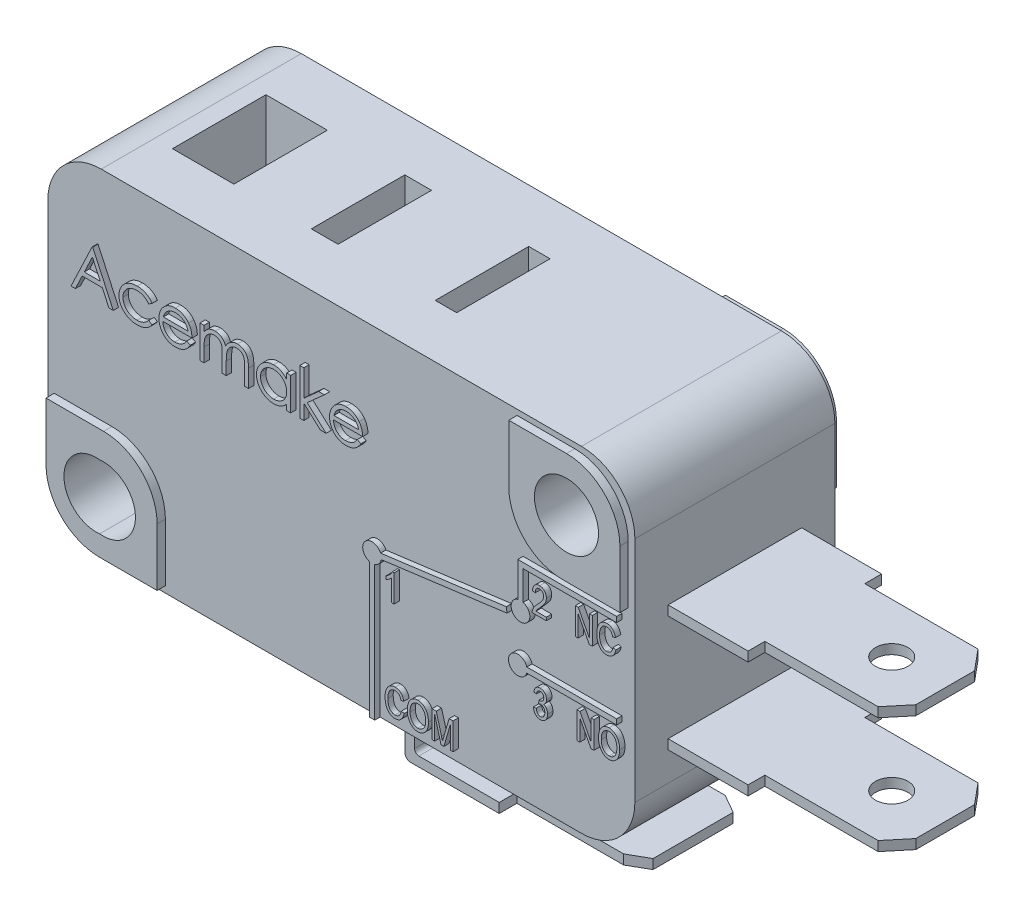
from build123d import *

# Parameters (mm, degrees)
BOSS_EXTRUDE1_DEPTH            = 9.5123
BOSS_EXTRUDE2_DEPTH            = 0.3937
BOSS_EXTRUDE2_DEPTH_BACK       = 9.906
CUT_EXTRUDE1_REACH             = 20.88
SKETCH2_R                      = 1.524
CUT_EXTRUDE1_DIRECTION_2_DEPTH = 0.4064
SKETCH4_R                      = 0.4445
BOSS_EXTRUDE5_DEPTH            = 0.254
BOSS_EXTRUDE6_DEPTH            = 0.254
BOSS_EXTRUDE6_2_DEPTH          = 0.254
BOSS_EXTRUDE6_3_DEPTH          = 0.254
BOSS_EXTRUDE6_4_DEPTH          = 0.254
BOSS_EXTRUDE6_5_DEPTH          = 0.254
BOSS_EXTRUDE6_6_DEPTH          = 0.254
BOSS_EXTRUDE6_7_DEPTH          = 0.254
BOSS_EXTRUDE6_8_DEPTH          = 0.254
BOSS_EXTRUDE6_9_DEPTH          = 0.254
BOSS_EXTRUDE6_10_DEPTH         = 0.254
BOSS_EXTRUDE6_11_DEPTH         = 0.254
BOSS_EXTRUDE6_12_DEPTH         = 0.254
BOSS_EXTRUDE6_13_DEPTH         = 0.254
BOSS_EXTRUDE6_14_DEPTH         = 0.254
BOSS_EXTRUDE6_15_DEPTH         = 0.254
BOSS_EXTRUDE6_16_DEPTH         = 0.254
BOSS_EXTRUDE6_17_DEPTH         = 0.254
SKETCH6_W                      = 6.35
SKETCH6_H                      = 0.4572
BOSS_EXTRUDE7_DEPTH            = 9.99998
CUT_EXTRUDE2_DEPTH             = 28.74622055
CUT_EXTRUDE2_DEPTH_BACK        = 28.74622055
SKETCH7_R                      = 0.7747
BOSS_EXTRUDE8_START            = -1.651
BOSS_EXTRUDE8_DEPTH            = 6.5024
SKETCH9_R                      = 0.7747
CUT_EXTRUDE3_DEPTH             = 0.4572
SKETCH12_W                     = 1.27
SKETCH12_H                     = 4.445
SKETCH12_W_2                   = 1.016
SKETCH12_W_3                   = 2.921
CUT_EXTRUDE4_DEPTH             = 2.9972


with BuildPart() as part:
    # Sketch1 → Boss-Extrude1 (new body)
    with BuildSketch(Plane.XY):
        with BuildLine():
            Line((-11.4173, 7.96925), (11.4173, 7.96925))
            ThreePointArc((11.4173, 7.96925), (13.213351224, 7.225301224), (13.9573, 5.42925))
            Line((13.9573, 5.42925), (13.9573, -5.42925))
            ThreePointArc((13.9573, -5.42925), (13.213351224, -7.225301224), (11.4173, -7.96925))
            Line((11.4173, -7.96925), (-11.4173, -7.96925))
            ThreePointArc((-11.4173, -7.96925), (-13.213351224, -7.225301224), (-13.9573, -5.42925))
            Line((-13.9573, -5.42925), (-13.9573, 5.42925))
            ThreePointArc((-13.9573, 5.42925), (-13.213351224, 7.225301224), (-11.4173, 7.96925))
        make_face()
    extrude(amount=-BOSS_EXTRUDE1_DEPTH)

    # Sketch3 → Boss-Extrude2 (add, two sides: drawn at the far end of the back side and taken through both)
    with BuildSketch(Plane.XY.offset(-BOSS_EXTRUDE2_DEPTH_BACK)):
        with BuildLine():
            Line((-13.6525, -2.38125), (-10.9093, -2.38125))
            ThreePointArc((-10.9093, -2.38125), (-9.113248776, -3.125198776), (-8.3693, -4.92125))
            Line((-8.3693, -4.92125), (-8.3693, -7.66445))
            Line((-8.3693, -7.66445), (-11.1125, -7.66445))
            ThreePointArc((-11.1125, -7.66445), (-12.908551224, -6.920501224), (-13.6525, -5.12445))
            Line((-13.6525, -5.12445), (-13.6525, -2.38125))
        make_face()
        with BuildLine():
            Line((13.639927, 2.42803971), (13.639927, 5.17123971))
            ThreePointArc((13.639927, 5.17123971), (12.895978224, 6.967290934), (11.099927, 7.71123971))
            Line((11.099927, 7.71123971), (8.356727, 7.71123971))
            Line((8.356727, 7.71123971), (8.356727, 4.96803971))
            ThreePointArc((8.356727, 4.96803971), (9.100675776, 3.171988485), (10.896727, 2.42803971))
            Line((10.896727, 2.42803971), (13.639927, 2.42803971))
        make_face()
    extrude(amount=BOSS_EXTRUDE2_DEPTH + BOSS_EXTRUDE2_DEPTH_BACK)

    # Sketch2 → Cut-Extrude1 (cut, up to next)
    with BuildSketch(Plane.XY, mode=Mode.PRIVATE) as cut_extrude1_sk1:
        with Locations(Location((11.099927, 5.17123971, 0), (0, 0, 180))):
            Circle(SKETCH2_R)
    cut_extrude1_tool1 = extrude(cut_extrude1_sk1.sketch, amount=-CUT_EXTRUDE1_REACH, mode=Mode.PRIVATE) & part.part
    # Sketch2 → Cut-Extrude1 (cut, up to next)
    with BuildSketch(Plane.XY, mode=Mode.PRIVATE) as cut_extrude1_sk2:
        with BuildLine():
            ThreePointArc((-11.099927, -3.64723971), (-9.400032922, -5.17123971), (-11.099927, -6.69523971))
            ThreePointArc((-11.099927, -6.69523971), (-12.799821942, -5.17123971), (-11.099927, -3.64723971))
        make_face()
    cut_extrude1_tool2 = extrude(cut_extrude1_sk2.sketch, amount=-CUT_EXTRUDE1_REACH, mode=Mode.PRIVATE) & part.part
    add(cut_extrude1_tool1.solids().sort_by_distance((11.099927, 5.17124, 0))[0], mode=Mode.SUBTRACT)
    add(cut_extrude1_tool2.solids().sort_by_distance((-11.099927, -5.17124, 0))[0], mode=Mode.SUBTRACT)

    # Sketch2 → Cut-Extrude1 direction 2 (cut)
    with BuildSketch(Plane.XY):
        with Locations(Location((11.099927, 5.17123971, 0), (0, 0, 180))):
            Circle(SKETCH2_R)
        with BuildLine():
            ThreePointArc((-11.099927, -3.64723971), (-9.400032922, -5.17123971), (-11.099927, -6.69523971))
            ThreePointArc((-11.099927, -6.69523971), (-12.799821942, -5.17123971), (-11.099927, -3.64723971))
        make_face()
    extrude(amount=CUT_EXTRUDE1_DIRECTION_2_DEPTH, mode=Mode.SUBTRACT)

    # Sketch4 → Boss-Extrude5 (add)
    with BuildSketch(Plane.XY):
        with BuildLine():
            Line((1.5875, -1.558083012), (1.5875, -7.96925))
            Line((1.5875, -7.96925), (1.8415, -7.96925))
            Line((1.8415, -7.96925), (1.8415, -1.558083012))
            ThreePointArc((1.8415, -1.558083012), (1.7145, -1.576612062), (1.5875, -1.558083012))
        make_face()
        with Locations((1.7145, -1.132112062)):
            Circle(SKETCH4_R)
        with BuildLine():
            Line((8.097630112, -0.166316337), (2.120323879, -0.950763697))
            ThreePointArc((2.120323879, -0.950763697), (2.149223455, -1.039398697), (2.159, -1.132112062))
            ThreePointArc((2.159, -1.132112062), (2.157591474, -1.167470169), (2.153374822, -1.202604192))
            Line((2.153374822, -1.202604192), (5.149603949, -0.809386255))
            Line((5.149603949, -0.809386255), (8.130681056, -0.418156832))
            Line((8.130681056, -0.418156832), (8.097630112, -0.166316337))
        make_face()
        with Locations((8.772606011, -0.017390227)):
            Circle(SKETCH4_R)
        with BuildLine():
            Line((13.344606011, 1.798709773), (13.344606011, 2.052709773))
            Line((13.344606011, 2.052709773), (8.645606011, 2.052709773))
            Line((8.645606011, 2.052709773), (8.645606011, 0.408580723))
            ThreePointArc((8.645606011, 0.408580723), (8.772606011, 0.427109773), (8.899606011, 0.408580723))
            Line((8.899606011, 0.408580723), (8.899606011, 1.798709773))
            Line((8.899606011, 1.798709773), (13.344606011, 1.798709773))
        make_face()
        with Locations((8.645606011, -2.290690227)):
            Circle(SKETCH4_R)
        with BuildLine():
            Line((13.344606011, -2.417690227), (13.344606011, -2.163690227))
            Line((13.344606011, -2.163690227), (9.071576961, -2.163690227))
            ThreePointArc((9.071576961, -2.163690227), (9.085449357, -2.226517948), (9.090106011, -2.290690227))
            ThreePointArc((9.090106011, -2.290690227), (9.085449357, -2.354862506), (9.071576961, -2.417690227))
            Line((9.071576961, -2.417690227), (13.344606011, -2.417690227))
        make_face()
    extrude(amount=BOSS_EXTRUDE5_DEPTH)

    # Sketch6 → Boss-Extrude7 (add)
    with BuildSketch(Plane(origin=(13.9573, 0, 0), x_dir=(0, 0, -1), z_dir=(1, 0, 0))):
        with Locations((4.75615, -3.821644447)):
            Rectangle(SKETCH6_W, SKETCH6_H)
        with Locations((4.75615, 1.690155553)):
            Rectangle(SKETCH6_W, SKETCH6_H)
    extrude(amount=BOSS_EXTRUDE7_DEPTH)

    # Sketch7 → Cut-Extrude2 (cut, two sides: drawn at the far end of the back side and taken through both)
    with BuildSketch(Plane(origin=(0, 1.918755553, 0), x_dir=(1, 0, 0), z_dir=(0, 1, 0)).offset(-CUT_EXTRUDE2_DEPTH_BACK)):
        Polygon((23.95728, 3.35915), (23.14448, 2.38125), (17.75968, 2.38125), (17.75968, 1.58115), (23.95728, 1.58115), align=None)
        Polygon((23.14448, 7.13105), (23.95728, 6.15315), (23.95728, 7.93115), (17.75968, 7.93115), (17.75968, 7.13105), align=None)
        with Locations(Location((21.41728, 4.75615, 0), (0, 0, 180))):
            Circle(SKETCH7_R)
    extrude(amount=CUT_EXTRUDE2_DEPTH + CUT_EXTRUDE2_DEPTH_BACK, mode=Mode.SUBTRACT)

    # Sketch8 → Boss-Extrude8 (add)
    with BuildSketch(Plane.XY.offset(BOSS_EXTRUDE8_START)):
        with BuildLine():
            Line((1.37206501, -7.965723789), (1.37206501, -10.493822967))
            ThreePointArc((1.37206501, -10.493822967), (1.449945558, -10.681843242), (1.637965833, -10.759723789))
            Line((1.637965833, -10.759723789), (11.824821625, -10.759723789))
            Line((11.824821625, -10.759723789), (11.824821625, -10.302523789))
            Line((11.824821625, -10.302523789), (2.03246501, -10.302523789))
            ThreePointArc((2.03246501, -10.302523789), (1.888780912, -10.243007887), (1.82926501, -10.099323789))
            Line((1.82926501, -10.099323789), (1.82926501, -7.965723789))
            Line((1.82926501, -7.965723789), (1.37206501, -7.965723789))
        make_face()
    extrude(amount=-BOSS_EXTRUDE8_DEPTH)

    # Sketch9 → Cut-Extrude3 (cut)
    with BuildSketch(Plane.XZ.offset(10.759723789)):
        with Locations((9.284821625, -4.9022)):
            Circle(SKETCH9_R)
        Polygon((10.935821625, -2.4892), (11.824821625, -2.9972), (11.824821625, -1.651), (5.855821625, -1.651), (5.855821625, -2.4892), align=None)
        Polygon((11.824821625, -8.1534), (11.824821625, -6.8072), (10.935821625, -7.3152), (5.855821625, -7.3152), (5.855821625, -8.1534), align=None)
    extrude(amount=-CUT_EXTRUDE3_DEPTH, mode=Mode.SUBTRACT)

    # Sketch12 → Cut-Extrude4 (cut)
    with BuildSketch(Plane(origin=(0, 7.96925, 0), x_dir=(1, 0, 0), z_dir=(0, 1, 0))):
        with Locations((-3.326607012, 4.75615)):
            Rectangle(SKETCH12_W, SKETCH12_H)
        with Locations((2.439192988, 4.75615)):
            Rectangle(SKETCH12_W_2, SKETCH12_H)
        with Locations((-9.105107012, 4.75615)):
            Rectangle(SKETCH12_W_3, SKETCH12_H)
    extrude(amount=-CUT_EXTRUDE4_DEPTH, mode=Mode.SUBTRACT)


with BuildPart() as body_2:
    # Sketch5 → Boss-Extrude6 (new body)
    with BuildSketch(Plane.XY.offset(0.254)):
        Polygon((-11.570784243, 4.803484776), (-10.593861166, 2.686818109), (-10.800354889, 2.686818109), (-11.113275562, 3.365236912), (-12.072814158, 3.365236912), (-12.394639077, 2.686818109), (-12.601980824, 2.686818109), (-11.597920995, 4.803484776), align=None)
        Polygon((-11.586472678, 4.390921341), (-11.969779302, 3.582330929), (-11.213342336, 3.582330929), align=None, mode=Mode.SUBTRACT)
    extrude(amount=-BOSS_EXTRUDE6_DEPTH)


with BuildPart() as body_3:
    # Sketch5 → Boss-Extrude6 2 (new body)
    with BuildSketch(Plane.XY.offset(0.254)):
        with BuildLine():
            Line((-8.748562021, 3.898219685), (-8.907566428, 3.799424947))
            add(Edge.make_bspline(
                [(-8.907566428, 3.799424947), (-8.925001632, 3.821092594), (-8.959319872, 3.86374168), (-9.018912648, 3.918781021), (-9.082419551, 3.96605347), (-9.150925799, 4.004579071), (-9.224335306, 4.034346329), (-9.302358574, 4.055410311), (-9.384984474, 4.06853621), (-9.441629618, 4.070028059), (-9.470654035, 4.070792468)],
                knots=[0, 0, 0, 0, 1.026593902, 2.0206758, 2.988051866, 3.946915611, 4.916868779, 5.907761954, 6.927957743, 8, 8, 8, 8], degree=3))
            add(Edge.make_bspline(
                [(-9.470654035, 4.070792468), (-9.493852071, 4.07015333), (-9.539539971, 4.068894565), (-9.606611788, 4.061026314), (-9.670500259, 4.046728529), (-9.73160583, 4.027889617), (-9.789493893, 4.002640632), (-9.844316115, 3.971912827), (-9.896558768, 3.936201612), (-9.944707941, 3.89482952), (-9.98875215, 3.84983604), (-10.026911969, 3.801604044), (-10.060135733, 3.751578205), (-10.086204574, 3.698509294), (-10.107537653, 3.643611395), (-10.121572193, 3.585848254), (-10.130924652, 3.525959887), (-10.131994675, 3.485127367), (-10.13253638, 3.464455662)],
                knots=[0, 0, 0, 0, 1.112346261, 2.190735716, 3.231507886, 4.247384806, 5.251966152, 6.253067467, 7.256802811, 8.280671706, 9.291813951, 10.270744147, 11.225547591, 12.165006084, 13.100104208, 14.043489273, 15.009504848, 16, 16, 16, 16], degree=3))
            add(Edge.make_bspline(
                [(-10.13253638, 3.464455662), (-10.131460356, 3.437380949), (-10.129322806, 3.383596331), (-10.112570019, 3.304204336), (-10.085147449, 3.227445723), (-10.047617225, 3.153865469), (-10.000157243, 3.085772813), (-9.944414789, 3.024701867), (-9.880358962, 2.971835983), (-9.808554171, 2.928007361), (-9.730686393, 2.892773105), (-9.647598092, 2.867671051), (-9.559968225, 2.852520331), (-9.499971763, 2.850611736), (-9.469381999, 2.849638622)],
                knots=[0, 0, 0, 0, 0.966302908, 1.919585723, 2.883856336, 3.870342332, 4.860282998, 5.839159637, 6.814385684, 7.815993281, 8.834850808, 9.858348828, 10.908058873, 12, 12, 12, 12], degree=3))
            add(Edge.make_bspline(
                [(-9.469381999, 2.849638622), (-9.44134815, 2.850424508), (-9.386254196, 2.851968983), (-9.305719695, 2.86498888), (-9.229048035, 2.886302887), (-9.15624194, 2.916025514), (-9.087434449, 2.954444535), (-9.023070139, 3.001833177), (-8.961868271, 3.056828168), (-8.925886766, 3.099353799), (-8.907566428, 3.121006143)],
                knots=[0, 0, 0, 0, 1.039848629, 2.043578496, 3.018386758, 3.987534228, 4.954977003, 5.934852016, 6.948509513, 8, 8, 8, 8], degree=3))
            Line((-8.907566428, 3.121006143), (-8.748562021, 3.016699252))
            add(Edge.make_bspline(
                [(-8.748562021, 3.016699252), (-8.757988869, 3.002855812), (-8.776811277, 2.975214881), (-8.808275603, 2.936241535), (-8.84221474, 2.899761279), (-8.878496279, 2.865823015), (-8.91664648, 2.833614593), (-8.957968597, 2.804675784), (-9.001130219, 2.777379963), (-9.046638043, 2.752818845), (-9.094021561, 2.730741212), (-9.143214097, 2.711757028), (-9.194001889, 2.695446535), (-9.246444649, 2.682482045), (-9.300645769, 2.672134061), (-9.356465072, 2.665267775), (-9.413883333, 2.660142248), (-9.452692205, 2.659836319), (-9.472350082, 2.659681357)],
                knots=[0, 0, 0, 0, 0.954134338, 1.905101784, 2.851144739, 3.791306361, 4.734911809, 5.6936923, 6.663572882, 7.643865596, 8.638447847, 9.640600242, 10.646758161, 11.676244097, 12.717260333, 13.78922464, 14.880174919, 16, 16, 16, 16], degree=3))
            add(Edge.make_bspline(
                [(-9.472350082, 2.659681357), (-9.502352854, 2.660220369), (-9.561158506, 2.661276836), (-9.647229737, 2.672893391), (-9.729485621, 2.690405854), (-9.807898057, 2.715542017), (-9.882479251, 2.747899666), (-9.953159661, 2.787425039), (-10.019705253, 2.834446359), (-10.081457964, 2.888126701), (-10.13817341, 2.946329374), (-10.186872582, 3.009133848), (-10.229112341, 3.074231053), (-10.263031951, 3.143058719), (-10.290032711, 3.214702063), (-10.308480871, 3.289735018), (-10.320412665, 3.367539), (-10.321793566, 3.420596505), (-10.322493645, 3.447495192)],
                knots=[0, 0, 0, 0, 1.1129367, 2.181364009, 3.217532258, 4.231199276, 5.232079859, 6.230262199, 7.231623845, 8.250719726, 9.263571943, 10.242672461, 11.195837495, 12.138959767, 13.085126421, 14.0317438, 15.002148558, 16, 16, 16, 16], degree=3))
            add(Edge.make_bspline(
                [(-10.322493645, 3.447495192), (-10.322226935, 3.46574596), (-10.321696405, 3.502049749), (-10.315611335, 3.555931051), (-10.307750353, 3.60909479), (-10.294430027, 3.660867078), (-10.279044502, 3.712033134), (-10.259404537, 3.761976248), (-10.236365894, 3.810928502), (-10.210208764, 3.858763796), (-10.180763666, 3.904695184), (-10.148178348, 3.948089067), (-10.113680107, 3.989466735), (-10.07565503, 4.027399676), (-10.035716763, 4.063404896), (-9.992735381, 4.096520524), (-9.946957414, 4.126843885), (-9.899070357, 4.154935689), (-9.849102079, 4.1799483), (-9.797354616, 4.201497925), (-9.744139784, 4.219914483), (-9.689372459, 4.234494639), (-9.633416154, 4.246721366), (-9.575829917, 4.254412635), (-9.516834049, 4.259847191), (-9.476885883, 4.260446384), (-9.456661647, 4.260749733)],
                knots=[0, 0, 0, 0, 0.990994727, 1.971252077, 2.943264845, 3.907940874, 4.872158414, 5.844625996, 6.82015047, 7.809835459, 8.804511986, 9.781214284, 10.756496977, 11.728388426, 12.696359165, 13.676225489, 14.672885716, 15.677705647, 16.690706858, 17.706033469, 18.721040654, 19.747369689, 20.783475414, 21.830280724, 22.901553713, 24, 24, 24, 24], degree=3))
            add(Edge.make_bspline(
                [(-9.456661647, 4.260749733), (-9.431334153, 4.260192208), (-9.380805764, 4.259079946), (-9.305851146, 4.249719047), (-9.232000529, 4.235606071), (-9.160549661, 4.214697741), (-9.092364865, 4.189380196), (-9.028541045, 4.160948698), (-8.970580601, 4.127931961), (-8.917405345, 4.091815511), (-8.868915827, 4.051078202), (-8.824614301, 4.005233042), (-8.783592303, 3.954518628), (-8.760335149, 3.917140876), (-8.748562021, 3.898219685)],
                knots=[0, 0, 0, 0, 1.095225653, 2.184976855, 3.262915854, 4.344593502, 5.400796181, 6.407717688, 7.363229445, 8.282371371, 9.184954523, 10.097238608, 11.036792983, 12, 12, 12, 12], degree=3))
        make_face()
    extrude(amount=-BOSS_EXTRUDE6_2_DEPTH)


with BuildPart() as body_4:
    # Sketch5 → Boss-Extrude6 3 (new body)
    with BuildSketch(Plane.XY.offset(0.254)):
        with BuildLine():
            Line((-7.099156305, 3.175279647), (-6.930399628, 3.086661191))
            add(Edge.make_bspline(
                [(-6.930399628, 3.086661191), (-6.943847473, 3.062807367), (-6.970011656, 3.016397271), (-7.015006394, 2.952636099), (-7.062173028, 2.895275813), (-7.113640666, 2.845848832), (-7.167869472, 2.802758709), (-7.225160172, 2.765059167), (-7.285811029, 2.73293511), (-7.34982491, 2.705870486), (-7.4177394, 2.685060934), (-7.489719079, 2.670362667), (-7.565901841, 2.661277167), (-7.618120721, 2.660221772), (-7.64485943, 2.659681357)],
                knots=[0, 0, 0, 0, 1.120438281, 2.179929193, 3.190490725, 4.156257408, 5.095198341, 6.022838206, 6.959905092, 7.901321166, 8.864066838, 9.862729781, 10.905609505, 12, 12, 12, 12], degree=3))
            add(Edge.make_bspline(
                [(-7.64485943, 2.659681357), (-7.674578626, 2.660375125), (-7.732552168, 2.661728465), (-7.816940491, 2.673395812), (-7.896393758, 2.692429096), (-7.970907502, 2.719017781), (-8.040299246, 2.753747639), (-8.104706906, 2.796056468), (-8.16446919, 2.845726927), (-8.217702879, 2.903189252), (-8.26562656, 2.964682626), (-8.307915032, 3.028760709), (-8.34326786, 3.095262278), (-8.372025867, 3.163763976), (-8.395251666, 3.233834045), (-8.411439149, 3.306110028), (-8.420770472, 3.380396309), (-8.422200399, 3.430650413), (-8.422920995, 3.455975427)],
                knots=[0, 0, 0, 0, 1.145258523, 2.234067595, 3.276747158, 4.290159414, 5.277019952, 6.260822364, 7.254936242, 8.264827045, 9.274100331, 10.257902744, 11.220704747, 12.172965371, 13.118907548, 14.062713208, 15.023725156, 16, 16, 16, 16], degree=3))
            add(Edge.make_bspline(
                [(-8.422920995, 3.455975427), (-8.422280467, 3.479739444), (-8.421011024, 3.526836586), (-8.413009548, 3.596544796), (-8.398828914, 3.664295337), (-8.379369899, 3.730144503), (-8.354241288, 3.793982041), (-8.323499898, 3.855846803), (-8.287097841, 3.915672959), (-8.258992939, 3.953411997), (-8.244836059, 3.972421741)],
                knots=[0, 0, 0, 0, 1.024358464, 2.0301432, 3.019427413, 4.004406732, 4.986367066, 5.972626655, 6.978780325, 8, 8, 8, 8], degree=3))
            add(Edge.make_bspline(
                [(-8.244836059, 3.972421741), (-8.225660461, 3.995323391), (-8.187916698, 4.040401225), (-8.124080235, 4.099630594), (-8.054955831, 4.149247543), (-7.981409752, 4.190375669), (-7.902587218, 4.221625922), (-7.819547789, 4.244913841), (-7.731345935, 4.2579634), (-7.671048016, 4.259806613), (-7.640195301, 4.260749733)],
                knots=[0, 0, 0, 0, 1.030682036, 2.02871468, 2.997146059, 3.962720338, 4.930598197, 5.918074684, 6.934738563, 8, 8, 8, 8], degree=3))
            add(Edge.make_bspline(
                [(-7.640195301, 4.260749733), (-7.608476987, 4.259930856), (-7.546252886, 4.258324405), (-7.455519175, 4.243431337), (-7.369666741, 4.21981384), (-7.288729941, 4.186458928), (-7.212700568, 4.143424342), (-7.142072814, 4.090119514), (-7.075638804, 4.028180957), (-7.036989331, 3.980547968), (-7.017322037, 3.956309295)],
                knots=[0, 0, 0, 0, 1.056321875, 2.072262726, 3.055038591, 4.01806755, 4.982017516, 5.957941055, 6.960871419, 8, 8, 8, 8], degree=3))
            add(Edge.make_bspline(
                [(-7.017322037, 3.956309295), (-7.003940507, 3.938043319), (-6.97726652, 3.901632952), (-6.943855179, 3.842262776), (-6.914852373, 3.780147322), (-6.891670059, 3.714282523), (-6.872898551, 3.645448777), (-6.859317522, 3.573154), (-6.851353039, 3.49741972), (-6.849787493, 3.44581747), (-6.848989371, 3.419510417)],
                knots=[0, 0, 0, 0, 0.94817472, 1.890038105, 2.849395472, 3.817997239, 4.812318967, 5.836947057, 6.897266129, 8, 8, 8, 8], degree=3))
            Line((-6.848989371, 3.419510417), (-8.23296373, 3.419510417))
            add(Edge.make_bspline(
                [(-8.23296373, 3.419510417), (-8.232032635, 3.39912966), (-8.230201674, 3.359051723), (-8.221665373, 3.300407488), (-8.208210162, 3.244543609), (-8.189299824, 3.191879103), (-8.166399398, 3.141726121), (-8.138347084, 3.094456699), (-8.10487983, 3.050286141), (-8.067550478, 3.008819348), (-8.025999045, 2.971892126), (-7.982285193, 2.938840814), (-7.935782894, 2.911139334), (-7.886858815, 2.888654353), (-7.835592069, 2.871051962), (-7.781966503, 2.859036661), (-7.726087642, 2.850989029), (-7.68799627, 2.850094184), (-7.668604088, 2.849638622)],
                knots=[0, 0, 0, 0, 1.094153842, 2.151609401, 3.174256925, 4.172055639, 5.149267565, 6.128595816, 7.11444997, 8.118368179, 9.117203808, 10.09244225, 11.054858984, 12.015122123, 12.976791628, 13.957293641, 14.960065497, 16, 16, 16, 16], degree=3))
            add(Edge.make_bspline(
                [(-7.668604088, 2.849638622), (-7.649644108, 2.850006351), (-7.612023871, 2.850735997), (-7.55599821, 2.85783101), (-7.500880496, 2.86930351), (-7.446898854, 2.88496079), (-7.395148866, 2.904057267), (-7.347224176, 2.927100424), (-7.303148998, 2.952590985), (-7.261954452, 2.98174636), (-7.221997232, 3.017432263), (-7.182359633, 3.061964342), (-7.13985899, 3.114631561), (-7.11325576, 3.154271083), (-7.099156305, 3.175279647)],
                knots=[0, 0, 0, 0, 0.99110716, 1.966546729, 2.947904876, 3.932708344, 4.903319531, 5.828989031, 6.710028674, 7.56322171, 8.463672341, 9.504779593, 10.677557249, 12, 12, 12, 12], degree=3))
        make_face()
        with BuildLine():
            add(Edge.make_bspline(
                [(-7.038946636, 3.609467682), (-7.045899357, 3.6346638), (-7.059281106, 3.683158219), (-7.087243098, 3.750311519), (-7.118733982, 3.809994202), (-7.156000457, 3.861749504), (-7.198224163, 3.907713533), (-7.246995297, 3.947880963), (-7.30168748, 3.983814374), (-7.362018008, 4.014144695), (-7.425906135, 4.039961895), (-7.492796547, 4.057273275), (-7.561048638, 4.069132379), (-7.607212706, 4.07023674), (-7.63044303, 4.070792468)],
                knots=[0, 0, 0, 0, 1.154881502, 2.222775134, 3.210006277, 4.132804581, 5.035138423, 5.962687519, 6.919655026, 7.923214229, 8.944639381, 9.960483929, 10.97369054, 12, 12, 12, 12], degree=3))
            add(Edge.make_bspline(
                [(-7.63044303, 4.070792468), (-7.649401977, 4.070422552), (-7.686879827, 4.069691307), (-7.742095235, 4.062754609), (-7.795120577, 4.051288418), (-7.846347108, 4.035585801), (-7.895103538, 4.014655837), (-7.942392755, 3.990112647), (-7.987012328, 3.960151785), (-8.014916826, 3.937316668), (-8.029014077, 3.925780449)],
                knots=[0, 0, 0, 0, 1.04873581, 2.073130211, 3.073294108, 4.04793562, 5.032784715, 6.005352987, 6.992311501, 8, 8, 8, 8], degree=3))
            add(Edge.make_bspline(
                [(-8.029014077, 3.925780449), (-8.039109538, 3.916651982), (-8.059540291, 3.898178189), (-8.086839559, 3.86635005), (-8.112977654, 3.832028867), (-8.136765149, 3.793901577), (-8.158583499, 3.752402344), (-8.179000247, 3.707881203), (-8.197376791, 3.66000031), (-8.207715867, 3.626634121), (-8.213035178, 3.609467682)],
                knots=[0, 0, 0, 0, 0.879870761, 1.780643979, 2.707998968, 3.669668524, 4.684282772, 5.740141944, 6.837334558, 8, 8, 8, 8], degree=3))
            Line((-8.213035178, 3.609467682), (-7.038946636, 3.609467682))
        make_face(mode=Mode.SUBTRACT)
    extrude(amount=-BOSS_EXTRUDE6_3_DEPTH)


with BuildPart() as body_5:
    # Sketch5 → Boss-Extrude6 4 (new body)
    with BuildSketch(Plane.XY.offset(0.254)):
        with BuildLine():
            Line((-6.469074841, 4.233612981), (-6.279117576, 4.233612981))
            Line((-6.279117576, 4.233612981), (-6.279117576, 3.96478953))
            add(Edge.make_bspline(
                [(-6.279117576, 3.96478953), (-6.262012521, 3.98830727), (-6.229237595, 4.033369515), (-6.175495034, 4.092751258), (-6.121806623, 4.143144951), (-6.083142149, 4.169598974), (-6.06456763, 4.182307559)],
                knots=[0, 0, 0, 0, 1.134379233, 2.173579362, 3.122582517, 4, 4, 4, 4], degree=3))
            add(Edge.make_bspline(
                [(-6.06456763, 4.182307559), (-6.039249477, 4.194406041), (-5.989055509, 4.218391632), (-5.909578168, 4.242723356), (-5.828253011, 4.257676156), (-5.773335663, 4.259721081), (-5.745710792, 4.260749733)],
                knots=[0, 0, 0, 0, 1.014936303, 2.012140481, 3.000054389, 4, 4, 4, 4], degree=3))
            add(Edge.make_bspline(
                [(-5.745710792, 4.260749733), (-5.727027885, 4.260117581), (-5.690055416, 4.258866586), (-5.635273609, 4.250726469), (-5.582140067, 4.236655974), (-5.530968726, 4.217057259), (-5.482756696, 4.193322358), (-5.438555133, 4.165473249), (-5.398868112, 4.134208827), (-5.363715691, 4.098117282), (-5.332105375, 4.056185149), (-5.30302912, 4.007281532), (-5.276162444, 3.950308327), (-5.261272415, 3.908962847), (-5.253433148, 3.887195379)],
                knots=[0, 0, 0, 0, 1.009824226, 1.998387844, 2.986035974, 3.974953746, 4.955485308, 5.885931332, 6.793869504, 7.679848016, 8.601185859, 9.625726857, 10.749998409, 12, 12, 12, 12], degree=3))
            add(Edge.make_bspline(
                [(-5.253433148, 3.887195379), (-5.245141105, 3.902147766), (-5.22882353, 3.931571964), (-5.201424407, 3.973214817), (-5.172717692, 4.012165592), (-5.142458737, 4.048455191), (-5.110754344, 4.081904409), (-5.077455306, 4.112623835), (-5.042751177, 4.140745393), (-4.99449587, 4.17359797), (-4.931713959, 4.208493447), (-4.852557814, 4.238748744), (-4.770219377, 4.257445641), (-4.714328674, 4.259641091), (-4.686105424, 4.260749733)],
                knots=[0, 0, 0, 0, 0.86119277, 1.694706429, 2.50939023, 3.298075842, 4.073795165, 4.829715201, 5.57930267, 6.321991688, 7.768977793, 9.186738141, 10.579381044, 12, 12, 12, 12], degree=3))
            add(Edge.make_bspline(
                [(-4.686105424, 4.260749733), (-4.660172348, 4.259771699), (-4.609418802, 4.257857593), (-4.535530647, 4.242827159), (-4.466622983, 4.217017344), (-4.402834466, 4.181799859), (-4.345285436, 4.137543876), (-4.295261763, 4.08488796), (-4.253067305, 4.024204564), (-4.22550308, 3.967119886), (-4.206806706, 3.916721851), (-4.195279198, 3.873779951), (-4.185095192, 3.826516869), (-4.176639867, 3.774876092), (-4.170460076, 3.7186752), (-4.165881596, 3.658006166), (-4.162782751, 3.592821836), (-4.162563784, 3.547848415), (-4.16245091, 3.524665331)],
                knots=[0, 0, 0, 0, 1.209669288, 2.367440248, 3.500751976, 4.631527125, 5.755587489, 6.87532382, 8.007944318, 9.190864318, 9.82315674, 10.514484317, 11.263564316, 12.079023757, 12.955305781, 13.901327259, 14.918167583, 16, 16, 16, 16], degree=3))
            Line((-4.16245091, 3.524665331), (-4.16245091, 2.686818109))
            Line((-4.16245091, 2.686818109), (-4.352408175, 2.686818109))
            Line((-4.352408175, 2.686818109), (-4.352408175, 3.525513355))
            add(Edge.make_bspline(
                [(-4.352408175, 3.525513355), (-4.352455275, 3.545301511), (-4.352545796, 3.583331339), (-4.354174801, 3.637912583), (-4.357244158, 3.687665352), (-4.360833201, 3.732521805), (-4.365818743, 3.772586548), (-4.372256997, 3.807779106), (-4.379077308, 3.838376316), (-4.390408122, 3.872295021), (-4.408519466, 3.909711767), (-4.43610718, 3.950063644), (-4.470862911, 3.985188699), (-4.510995006, 4.015679777), (-4.556683827, 4.040471169), (-4.60703916, 4.058176185), (-4.661748372, 4.069136211), (-4.699620249, 4.070228421), (-4.71917834, 4.070792468)],
                knots=[0, 0, 0, 0, 1.253487763, 2.409012846, 3.458416907, 4.410876679, 5.259312806, 6.014470957, 6.676830364, 7.243083969, 8.276244668, 9.299465089, 10.325150304, 11.392391894, 12.482080715, 13.603491619, 14.762376348, 16, 16, 16, 16], degree=3))
            add(Edge.make_bspline(
                [(-4.71917834, 4.070792468), (-4.743169217, 4.06993603), (-4.790584311, 4.068243383), (-4.859796582, 4.050962993), (-4.926302863, 4.024909698), (-4.988118682, 3.987152927), (-5.044983107, 3.941911678), (-5.09390809, 3.888118351), (-5.13432565, 3.827261205), (-5.161693531, 3.770929628), (-5.178983251, 3.720329535), (-5.19039929, 3.67612303), (-5.199279246, 3.625878462), (-5.207607138, 3.569933456), (-5.213042573, 3.507902918), (-5.217982494, 3.44007379), (-5.220293206, 3.366242062), (-5.220616426, 3.315063065), (-5.220784243, 3.288490785)],
                knots=[0, 0, 0, 0, 1.090531906, 2.155305635, 3.229839962, 4.33261226, 5.44038871, 6.529323825, 7.629011124, 8.757537029, 9.370236727, 10.061839251, 10.834451254, 11.692844982, 12.636905849, 13.66920014, 14.789842145, 16, 16, 16, 16], degree=3))
            Line((-5.220784243, 3.288490785), (-5.220784243, 2.686818109))
            Line((-5.220784243, 2.686818109), (-5.410741508, 2.686818109))
            Line((-5.410741508, 2.686818109), (-5.410741508, 3.473359909))
            add(Edge.make_bspline(
                [(-5.410741508, 3.473359909), (-5.410789545, 3.49555063), (-5.410881963, 3.538243348), (-5.412500498, 3.599465618), (-5.415576693, 3.655152748), (-5.419133024, 3.705240014), (-5.424249418, 3.749636389), (-5.430061036, 3.788579885), (-5.436924243, 3.821972873), (-5.44828765, 3.858599301), (-5.465653066, 3.898949573), (-5.493585968, 3.941972953), (-5.528424838, 3.979630326), (-5.569289129, 4.011778712), (-5.61525447, 4.038352846), (-5.666044432, 4.057499458), (-5.721201689, 4.068641766), (-5.75922773, 4.070062048), (-5.778783709, 4.070792468)],
                knots=[0, 0, 0, 0, 1.320475261, 2.540461679, 3.643808994, 4.639130445, 5.527981419, 6.302341397, 6.981980563, 7.553956391, 8.582137848, 9.585246428, 10.591171744, 11.620968678, 12.668337649, 13.738356861, 14.836885341, 16, 16, 16, 16], degree=3))
            add(Edge.make_bspline(
                [(-5.778783709, 4.070792468), (-5.801774465, 4.069866904), (-5.847594226, 4.068022288), (-5.914905418, 4.051418989), (-5.979908664, 4.025411763), (-6.041566982, 3.989331777), (-6.098217539, 3.944640429), (-6.147813015, 3.892077612), (-6.189506828, 3.832297482), (-6.217163687, 3.776559893), (-6.23500324, 3.727227484), (-6.246853752, 3.685286673), (-6.257037717, 3.638719856), (-6.26460572, 3.587383365), (-6.271911495, 3.531611561), (-6.275437444, 3.471126607), (-6.278867389, 3.405980392), (-6.279032135, 3.36100271), (-6.279117576, 3.337676148)],
                knots=[0, 0, 0, 0, 1.098833095, 2.189935336, 3.297829714, 4.440610912, 5.596351641, 6.740013378, 7.886572111, 9.072425424, 9.705826452, 10.395263256, 11.156850408, 11.985370555, 12.878090359, 13.847760091, 14.883794034, 16, 16, 16, 16], degree=3))
            Line((-6.279117576, 3.337676148), (-6.279117576, 2.686818109))
            Line((-6.279117576, 2.686818109), (-6.469074841, 2.686818109))
            Line((-6.469074841, 2.686818109), (-6.469074841, 4.233612981))
        make_face()
    extrude(amount=-BOSS_EXTRUDE6_4_DEPTH)


with BuildPart() as body_6:
    # Sketch5 → Boss-Extrude6 5 (new body)
    with BuildSketch(Plane.XY.offset(0.254)):
        with BuildLine():
            Line((-2.154331252, 4.233612981), (-2.154331252, 2.686818109))
            Line((-2.154331252, 2.686818109), (-2.344288517, 2.686818109))
            Line((-2.344288517, 2.686818109), (-2.344288517, 2.954369524))
            add(Edge.make_bspline(
                [(-2.344288517, 2.954369524), (-2.365708452, 2.930155103), (-2.407509725, 2.882900356), (-2.477324115, 2.821164947), (-2.551327728, 2.770136153), (-2.629161384, 2.72892168), (-2.710754798, 2.697962674), (-2.795927098, 2.675957711), (-2.884713028, 2.661810011), (-2.945341833, 2.660397274), (-2.976066027, 2.659681357)],
                knots=[0, 0, 0, 0, 1.074387032, 2.096679803, 3.090159297, 4.057316773, 5.018401886, 5.985159533, 6.978961417, 8, 8, 8, 8], degree=3))
            add(Edge.make_bspline(
                [(-2.976066027, 2.659681357), (-3.003381885, 2.66042302), (-3.057249966, 2.661885613), (-3.13649136, 2.673232339), (-3.212747149, 2.691454191), (-3.286089391, 2.716794253), (-3.356043498, 2.750407417), (-3.423208413, 2.790649029), (-3.487236184, 2.838570864), (-3.547150877, 2.893355052), (-3.602324515, 2.952860592), (-3.650742523, 3.016327661), (-3.691112243, 3.083481816), (-3.724870101, 3.153472819), (-3.750872652, 3.226839461), (-3.768999564, 3.303328034), (-3.780333073, 3.3828481), (-3.781795061, 3.436998193), (-3.78253638, 3.464455662)],
                knots=[0, 0, 0, 0, 1.033919861, 2.038935746, 3.024066025, 3.998881131, 4.97069526, 5.957263378, 6.95902576, 7.993208707, 9.027059324, 10.027763471, 11.009749337, 11.988697705, 12.965288445, 13.950418724, 14.960734635, 16, 16, 16, 16], degree=3))
            add(Edge.make_bspline(
                [(-3.78253638, 3.464455662), (-3.78177863, 3.491345616), (-3.780280601, 3.544505605), (-3.769120796, 3.622688437), (-3.750354425, 3.697992337), (-3.724018345, 3.770174869), (-3.690247258, 3.839323376), (-3.649166939, 3.905486763), (-3.600774421, 3.968847303), (-3.544983679, 4.02791514), (-3.484546937, 4.082477131), (-3.41989261, 4.129895934), (-3.352629006, 4.170848505), (-3.281712804, 4.203296083), (-3.208193651, 4.229548256), (-3.131417043, 4.247711051), (-3.051702422, 4.258413717), (-2.997581981, 4.259963579), (-2.970129863, 4.260749733)],
                knots=[0, 0, 0, 0, 1.020392517, 2.01726096, 2.990465484, 3.961182959, 4.928053699, 5.906110375, 6.912531644, 7.948652711, 8.985773172, 9.998621852, 10.987621588, 11.969261332, 12.953316658, 13.946091881, 14.958173133, 16, 16, 16, 16], degree=3))
            add(Edge.make_bspline(
                [(-2.970129863, 4.260749733), (-2.938561376, 4.259880235), (-2.876657065, 4.258175192), (-2.786107269, 4.243985829), (-2.700446085, 4.220013994), (-2.619012262, 4.187406745), (-2.542098228, 4.144076323), (-2.470432138, 4.089417966), (-2.403263965, 4.023776391), (-2.364329217, 3.973357122), (-2.344288517, 3.947405048)],
                knots=[0, 0, 0, 0, 1.038897134, 2.037228247, 3.008116434, 3.962042015, 4.918381754, 5.904844433, 6.921570401, 8, 8, 8, 8], degree=3))
            Line((-2.344288517, 3.947405048), (-2.344288517, 4.233612981))
            Line((-2.344288517, 4.233612981), (-2.154331252, 4.233612981))
        make_face()
        with BuildLine():
            add(Edge.make_bspline(
                [(-2.967585792, 4.070792468), (-2.995353035, 4.069804506), (-3.050161155, 4.067854426), (-3.130621099, 4.052630456), (-3.207615402, 4.027300248), (-3.28075898, 3.992658337), (-3.348896425, 3.949098101), (-3.409792121, 3.896410407), (-3.463944136, 3.836032784), (-3.509487705, 3.768237698), (-3.546614339, 3.695558567), (-3.572720115, 3.619585693), (-3.589937232, 3.541689349), (-3.591696194, 3.488855725), (-3.592579115, 3.462335604)],
                knots=[0, 0, 0, 0, 1.031046209, 2.035121221, 3.029706178, 4.034933723, 5.034054252, 6.02443088, 7.017295772, 8.038157696, 9.050218397, 10.03989886, 11.016116709, 12, 12, 12, 12], degree=3))
            add(Edge.make_bspline(
                [(-3.592579115, 3.462335604), (-3.591451298, 3.435973967), (-3.589200086, 3.383354024), (-3.573022285, 3.305351484), (-3.545880648, 3.229360706), (-3.508843781, 3.156026677), (-3.462466632, 3.087940102), (-3.408710161, 3.026411552), (-3.347054515, 2.973501182), (-3.27876026, 2.929209887), (-3.205821154, 2.893430648), (-3.129116824, 2.868535238), (-3.050089177, 2.852462009), (-2.99635467, 2.850584539), (-2.969281839, 2.849638622)],
                knots=[0, 0, 0, 0, 0.979072187, 1.954306742, 2.945804271, 3.96968567, 4.997920485, 5.998718438, 6.996577872, 8.005894225, 9.015743152, 10.005417472, 10.995077863, 12, 12, 12, 12], degree=3))
            add(Edge.make_bspline(
                [(-2.969281839, 2.849638622), (-2.941797526, 2.850642505), (-2.887133952, 2.852639128), (-2.806435305, 2.867928274), (-2.728121684, 2.893188452), (-2.653259884, 2.928203639), (-2.583521081, 2.971599754), (-2.520929508, 3.022404042), (-2.468003184, 3.081491206), (-2.42313432, 3.146428394), (-2.387952044, 3.217616125), (-2.362324618, 3.293413469), (-2.34717297, 3.373823065), (-2.345263296, 3.428774106), (-2.344288517, 3.456823451)],
                knots=[0, 0, 0, 0, 1.01762866, 2.023962475, 3.030623092, 4.058876274, 5.077231937, 6.066672613, 7.034107872, 8.005628644, 8.981990164, 9.965428785, 10.961468474, 12, 12, 12, 12], degree=3))
            add(Edge.make_bspline(
                [(-2.344288517, 3.456823451), (-2.34486888, 3.478194424), (-2.346011219, 3.520259264), (-2.354738278, 3.582022096), (-2.368620543, 3.64112773), (-2.388182275, 3.697638309), (-2.413879385, 3.751241389), (-2.444872081, 3.802321854), (-2.481705377, 3.850614034), (-2.523786341, 3.895452939), (-2.569848154, 3.936350847), (-2.618588662, 3.97285684), (-2.670585332, 4.002846241), (-2.724963731, 4.027666438), (-2.781818205, 4.047417448), (-2.841611389, 4.060593815), (-2.903707729, 4.069641248), (-2.946068915, 4.070404687), (-2.967585792, 4.070792468)],
                knots=[0, 0, 0, 0, 1.050140795, 2.067009409, 3.05949893, 4.030605086, 5.00011959, 5.97591094, 6.962425594, 7.979863591, 8.993523472, 9.986985069, 10.967611495, 11.937549037, 12.921786183, 13.919465291, 14.943216303, 16, 16, 16, 16], degree=3))
        make_face(mode=Mode.SUBTRACT)
    extrude(amount=-BOSS_EXTRUDE6_5_DEPTH)


with BuildPart() as body_7:
    # Sketch5 → Boss-Extrude6 6 (new body)
    with BuildSketch(Plane.XY.offset(0.254)):
        Polygon((-1.720143217, 4.85775828), (-1.530185952, 4.85775828), (-1.530185952, 3.602683494), (-0.826326444, 4.233612981), (-0.553262876, 4.233612981), (-1.36990951, 3.500920673), (-0.471852619, 2.686818109), (-0.744492176, 2.686818109), (-1.530185952, 3.399581864), (-1.530185952, 2.686818109), (-1.720143217, 2.686818109), align=None)
    extrude(amount=-BOSS_EXTRUDE6_6_DEPTH)


with BuildPart() as body_8:
    # Sketch5 → Boss-Extrude6 7 (new body)
    with BuildSketch(Plane.XY.offset(0.254)):
        with BuildLine():
            Line((1.014732584, 3.175279647), (1.183489261, 3.086661191))
            add(Edge.make_bspline(
                [(1.183489261, 3.086661191), (1.170041416, 3.062807367), (1.143877233, 3.016397271), (1.098882495, 2.952636099), (1.051715861, 2.895275813), (1.000248223, 2.845848832), (0.946019417, 2.802758709), (0.888728717, 2.765059167), (0.82807786, 2.73293511), (0.764063979, 2.705870486), (0.696149488, 2.685060934), (0.624169809, 2.670362667), (0.547987048, 2.661277167), (0.495768168, 2.660221772), (0.469029459, 2.659681357)],
                knots=[0, 0, 0, 0, 1.120438281, 2.179929193, 3.190490725, 4.156257408, 5.095198341, 6.022838206, 6.959905092, 7.901321166, 8.864066838, 9.862729781, 10.905609505, 12, 12, 12, 12], degree=3))
            add(Edge.make_bspline(
                [(0.469029459, 2.659681357), (0.439310263, 2.660375125), (0.381336721, 2.661728465), (0.296948398, 2.673395812), (0.217495131, 2.692429096), (0.142981386, 2.719017781), (0.073589643, 2.753747639), (0.009181983, 2.796056468), (-0.050580301, 2.845726927), (-0.10381399, 2.903189252), (-0.151737671, 2.964682626), (-0.194026143, 3.028760709), (-0.229378971, 3.095262278), (-0.258136978, 3.163763976), (-0.281362777, 3.233834045), (-0.29755026, 3.306110028), (-0.306881584, 3.380396309), (-0.30831151, 3.430650413), (-0.309032106, 3.455975427)],
                knots=[0, 0, 0, 0, 1.145258523, 2.234067595, 3.276747158, 4.290159414, 5.277019952, 6.260822364, 7.254936242, 8.264827045, 9.274100331, 10.257902744, 11.220704747, 12.172965371, 13.118907548, 14.062713208, 15.023725156, 16, 16, 16, 16], degree=3))
            add(Edge.make_bspline(
                [(-0.309032106, 3.455975427), (-0.308391578, 3.479739444), (-0.307122135, 3.526836586), (-0.299120659, 3.596544796), (-0.284940025, 3.664295337), (-0.26548101, 3.730144503), (-0.240352399, 3.793982041), (-0.209611009, 3.855846803), (-0.173208952, 3.915672959), (-0.14510405, 3.953411997), (-0.13094717, 3.972421741)],
                knots=[0, 0, 0, 0, 1.024358464, 2.0301432, 3.019427413, 4.004406732, 4.986367066, 5.972626655, 6.978780325, 8, 8, 8, 8], degree=3))
            add(Edge.make_bspline(
                [(-0.13094717, 3.972421741), (-0.111771572, 3.995323391), (-0.074027809, 4.040401225), (-0.010191346, 4.099630594), (0.058933058, 4.149247543), (0.132479137, 4.190375669), (0.211301671, 4.221625922), (0.2943411, 4.244913841), (0.382542954, 4.2579634), (0.442840873, 4.259806613), (0.473693588, 4.260749733)],
                knots=[0, 0, 0, 0, 1.030682036, 2.02871468, 2.997146059, 3.962720338, 4.930598197, 5.918074684, 6.934738563, 8, 8, 8, 8], degree=3))
            add(Edge.make_bspline(
                [(0.473693588, 4.260749733), (0.505411902, 4.259930856), (0.567636003, 4.258324405), (0.658369714, 4.243431337), (0.744222148, 4.21981384), (0.825158948, 4.186458928), (0.901188321, 4.143424342), (0.971816075, 4.090119514), (1.038250085, 4.028180957), (1.076899558, 3.980547968), (1.096566852, 3.956309295)],
                knots=[0, 0, 0, 0, 1.056321875, 2.072262726, 3.055038591, 4.01806755, 4.982017516, 5.957941055, 6.960871419, 8, 8, 8, 8], degree=3))
            add(Edge.make_bspline(
                [(1.096566852, 3.956309295), (1.109948381, 3.938043319), (1.136622369, 3.901632952), (1.17003371, 3.842262776), (1.199036516, 3.780147322), (1.22221883, 3.714282523), (1.240990338, 3.645448777), (1.254571367, 3.573154), (1.26253585, 3.49741972), (1.264101396, 3.44581747), (1.264899518, 3.419510417)],
                knots=[0, 0, 0, 0, 0.94817472, 1.890038105, 2.849395472, 3.817997239, 4.812318967, 5.836947057, 6.897266129, 8, 8, 8, 8], degree=3))
            Line((1.264899518, 3.419510417), (-0.119074841, 3.419510417))
            add(Edge.make_bspline(
                [(-0.119074841, 3.419510417), (-0.118143746, 3.39912966), (-0.116312785, 3.359051723), (-0.107776484, 3.300407488), (-0.094321273, 3.244543609), (-0.075410935, 3.191879103), (-0.05251051, 3.141726121), (-0.024458195, 3.094456699), (0.009009059, 3.050286141), (0.04633841, 3.008819348), (0.087889844, 2.971892126), (0.131603696, 2.938840814), (0.178105995, 2.911139334), (0.227030074, 2.888654353), (0.27829682, 2.871051962), (0.331922386, 2.859036661), (0.387801247, 2.850989029), (0.425892619, 2.850094184), (0.445284801, 2.849638622)],
                knots=[0, 0, 0, 0, 1.094153842, 2.151609401, 3.174256925, 4.172055639, 5.149267565, 6.128595816, 7.11444997, 8.118368179, 9.117203808, 10.09244225, 11.054858984, 12.015122123, 12.976791628, 13.957293641, 14.960065497, 16, 16, 16, 16], degree=3))
            add(Edge.make_bspline(
                [(0.445284801, 2.849638622), (0.464244781, 2.850006351), (0.501865017, 2.850735997), (0.557890679, 2.85783101), (0.613008393, 2.86930351), (0.666990035, 2.88496079), (0.718740023, 2.904057267), (0.766664713, 2.927100424), (0.810739891, 2.952590985), (0.851934437, 2.98174636), (0.891891657, 3.017432263), (0.931529256, 3.061964342), (0.974029899, 3.114631561), (1.000633129, 3.154271083), (1.014732584, 3.175279647)],
                knots=[0, 0, 0, 0, 0.99110716, 1.966546729, 2.947904876, 3.932708344, 4.903319531, 5.828989031, 6.710028674, 7.56322171, 8.463672341, 9.504779593, 10.677557249, 12, 12, 12, 12], degree=3))
        make_face()
        with BuildLine():
            add(Edge.make_bspline(
                [(1.074942253, 3.609467682), (1.067989532, 3.6346638), (1.054607783, 3.683158219), (1.026645791, 3.750311519), (0.995154907, 3.809994202), (0.957888432, 3.861749504), (0.915664726, 3.907713533), (0.866893592, 3.947880963), (0.812201409, 3.983814374), (0.751870881, 4.014144695), (0.687982753, 4.039961895), (0.621092342, 4.057273275), (0.552840251, 4.069132379), (0.506676183, 4.07023674), (0.483445858, 4.070792468)],
                knots=[0, 0, 0, 0, 1.154881502, 2.222775134, 3.210006277, 4.132804581, 5.035138423, 5.962687519, 6.919655026, 7.923214229, 8.944639381, 9.960483929, 10.97369054, 12, 12, 12, 12], degree=3))
            add(Edge.make_bspline(
                [(0.483445858, 4.070792468), (0.464486912, 4.070422552), (0.427009062, 4.069691307), (0.371793654, 4.062754609), (0.318768312, 4.051288418), (0.267541781, 4.035585801), (0.218785351, 4.014655837), (0.171496134, 3.990112647), (0.126876561, 3.960151785), (0.098972063, 3.937316668), (0.084874811, 3.925780449)],
                knots=[0, 0, 0, 0, 1.04873581, 2.073130211, 3.073294108, 4.04793562, 5.032784715, 6.005352987, 6.992311501, 8, 8, 8, 8], degree=3))
            add(Edge.make_bspline(
                [(0.084874811, 3.925780449), (0.07477935, 3.916651982), (0.054348598, 3.898178189), (0.02704933, 3.86635005), (0.000911235, 3.832028867), (-0.02287626, 3.793901577), (-0.04469461, 3.752402344), (-0.065111358, 3.707881203), (-0.083487903, 3.66000031), (-0.093826979, 3.626634121), (-0.099146289, 3.609467682)],
                knots=[0, 0, 0, 0, 0.879870761, 1.780643979, 2.707998968, 3.669668524, 4.684282772, 5.740141944, 6.837334558, 8, 8, 8, 8], degree=3))
            Line((-0.099146289, 3.609467682), (1.074942253, 3.609467682))
        make_face(mode=Mode.SUBTRACT)
    extrude(amount=-BOSS_EXTRUDE6_7_DEPTH)


with BuildPart() as body_9:
    # Sketch5 → Boss-Extrude6 8 (new body)
    with BuildSketch(Plane.XY.offset(0.254)):
        with BuildLine():
            Line((3.108408182, -6.962082483), (3.240356234, -6.995069496))
            add(Edge.make_bspline(
                [(3.240356234, -6.995069496), (3.2364235, -7.012555035), (3.228756309, -7.046644541), (3.214375189, -7.095676388), (3.197570533, -7.14118175), (3.178802523, -7.183333018), (3.157920663, -7.22213666), (3.135027742, -7.257565983), (3.109931055, -7.289592031), (3.082505591, -7.317820425), (3.05366686, -7.343148772), (3.022743151, -7.364409459), (2.99066482, -7.383042506), (2.956818959, -7.397882922), (2.921547192, -7.409637227), (2.88465963, -7.417745898), (2.84630615, -7.423179702), (2.820134556, -7.423658363), (2.806886267, -7.423900665)],
                knots=[0, 0, 0, 0, 1.289221957, 2.51344498, 3.673011535, 4.776835723, 5.830430132, 6.840130389, 7.808269491, 8.7523986, 9.668123701, 10.564817631, 11.447926293, 12.333367568, 13.218722559, 14.118350969, 15.047492789, 16, 16, 16, 16], degree=3))
            add(Edge.make_bspline(
                [(2.806886267, -7.423900665), (2.795193543, -7.423739323), (2.77227306, -7.423423054), (2.73854241, -7.419847818), (2.706027424, -7.414625522), (2.674803379, -7.406763242), (2.644801493, -7.397138223), (2.616311433, -7.384776899), (2.588870261, -7.370708867), (2.56279206, -7.354083327), (2.537767, -7.33524874), (2.514466682, -7.313349627), (2.491764042, -7.289411404), (2.470822481, -7.262290223), (2.450220474, -7.233067368), (2.431698986, -7.200650199), (2.413730934, -7.165987128), (2.397183834, -7.128799435), (2.381771316, -7.089461075), (2.36918501, -7.04791364), (2.357959447, -7.004880224), (2.349050277, -6.960027291), (2.341699452, -6.91354119), (2.337044477, -6.865169621), (2.333754431, -6.815146761), (2.333395745, -6.78117504), (2.333213377, -6.763902694)],
                knots=[0, 0, 0, 0, 0.921095259, 1.805562833, 2.670327692, 3.514278933, 4.340642213, 5.150451062, 5.958900505, 6.768369716, 7.58482939, 8.423223242, 9.285360719, 10.181948201, 11.120907027, 12.10087379, 13.121233649, 14.196976745, 15.307105309, 16.44839936, 17.61583717, 18.810746038, 20.050660639, 21.323136918, 22.638994396, 24, 24, 24, 24], degree=3))
            add(Edge.make_bspline(
                [(2.333213377, -6.763902694), (2.333394256, -6.74688789), (2.333749015, -6.713516554), (2.337033674, -6.664523312), (2.341676804, -6.617434323), (2.34905353, -6.572411207), (2.357901755, -6.52925805), (2.369085415, -6.488262043), (2.381860062, -6.449085911), (2.397050651, -6.412104305), (2.414168486, -6.377287755), (2.432460327, -6.34449139), (2.451968573, -6.313712234), (2.473139747, -6.285265587), (2.49586082, -6.259222084), (2.519947382, -6.235320915), (2.545524509, -6.213710739), (2.572296251, -6.194000515), (2.600350591, -6.176917814), (2.629108939, -6.161747419), (2.658787639, -6.14916008), (2.689278376, -6.138816535), (2.720551681, -6.130776199), (2.752619336, -6.125248078), (2.785400585, -6.121348959), (2.807561838, -6.121059612), (2.818740975, -6.120913652)],
                knots=[0, 0, 0, 0, 1.355009242, 2.657595594, 3.909622363, 5.12221665, 6.289669639, 7.416642245, 8.504963989, 9.569716403, 10.597874851, 11.593392335, 12.559484071, 13.498222117, 14.414780627, 15.309839368, 16.198178116, 17.079506653, 17.954919271, 18.811820418, 19.667108407, 20.519600343, 21.37423126, 22.235899437, 23.110108003, 24, 24, 24, 24], degree=3))
            add(Edge.make_bspline(
                [(2.818740975, -6.120913652), (2.830950202, -6.121229747), (2.854933269, -6.121850664), (2.890357366, -6.1261988), (2.924244487, -6.134107044), (2.957164662, -6.144295513), (2.988500109, -6.158068557), (3.018655697, -6.17463855), (3.047368411, -6.194354744), (3.074657, -6.217095696), (3.100491837, -6.242579913), (3.124287721, -6.271074359), (3.145827425, -6.302452704), (3.165948062, -6.336275602), (3.183277756, -6.373367439), (3.198902806, -6.41307592), (3.213129037, -6.45546885), (3.220224751, -6.485081749), (3.223862728, -6.500264302)],
                knots=[0, 0, 0, 0, 0.969230344, 1.90389736, 2.827024372, 3.728538081, 4.635631584, 5.539103428, 6.456494714, 7.396000419, 8.355610671, 9.333534695, 10.338037519, 11.374284513, 12.454112223, 13.583699076, 14.761161004, 16, 16, 16, 16], degree=3))
            Line((3.223862728, -6.500264302), (3.091914676, -6.533251315))
            add(Edge.make_bspline(
                [(3.091914676, -6.533251315), (3.088932381, -6.522565812), (3.08311601, -6.501725872), (3.072765614, -6.471793366), (3.061445128, -6.443904568), (3.049141938, -6.417984183), (3.035441339, -6.394257135), (3.020743762, -6.372530069), (3.005024051, -6.352742499), (2.987952025, -6.335311665), (2.970095865, -6.319584183), (2.950908401, -6.306111146), (2.930548946, -6.294855669), (2.909201475, -6.285394071), (2.88679853, -6.278277262), (2.863266442, -6.273035209), (2.838667762, -6.269943178), (2.821842119, -6.269552751), (2.813329043, -6.269355211)],
                knots=[0, 0, 0, 0, 1.274827499, 2.486296693, 3.637698816, 4.732866786, 5.781146847, 6.783409552, 7.745577291, 8.681189198, 9.583979081, 10.476943643, 11.369744444, 12.253932728, 13.156290603, 14.066553906, 15.021756508, 16, 16, 16, 16], degree=3))
            add(Edge.make_bspline(
                [(2.813329043, -6.269355211), (2.79652591, -6.26997775), (2.763737144, -6.271192541), (2.716314654, -6.281297341), (2.672190704, -6.297460355), (2.638607761, -6.316854991), (2.613708005, -6.335457347), (2.596058621, -6.351360933), (2.579440182, -6.369115273), (2.56365038, -6.388551295), (2.548693436, -6.409827973), (2.535205432, -6.433204328), (2.522124467, -6.458017179), (2.51033712, -6.484796179), (2.499836178, -6.513394078), (2.490496217, -6.543748989), (2.482530243, -6.57591463), (2.47610451, -6.609988909), (2.47132677, -6.645875483), (2.46764316, -6.683603873), (2.465665213, -6.723163098), (2.465331418, -6.750156168), (2.465161429, -6.763902694)],
                knots=[0, 0, 0, 0, 1.477189771, 2.882511776, 4.245778241, 5.596752156, 6.277022015, 6.978177212, 7.684002091, 8.414723124, 9.180080371, 9.969542299, 10.787683758, 11.647234596, 12.541638645, 13.466905688, 14.440346501, 15.45581228, 16.516221105, 17.624831929, 18.790418795, 20, 20, 20, 20], degree=3))
            add(Edge.make_bspline(
                [(2.465161429, -6.763902694), (2.465487376, -6.784526043), (2.466119575, -6.824526549), (2.470150718, -6.882620333), (2.477203431, -6.93679868), (2.487556821, -6.986880985), (2.500345455, -7.033028406), (2.515904809, -7.075258597), (2.534824671, -7.113394259), (2.556439711, -7.147514721), (2.580557002, -7.17759536), (2.606578101, -7.20380367), (2.634667233, -7.225871896), (2.664483241, -7.244220997), (2.696470071, -7.258100004), (2.730178602, -7.268252256), (2.765867379, -7.274274672), (2.790283836, -7.275058499), (2.80276289, -7.275459107)],
                knots=[0, 0, 0, 0, 1.437104972, 2.787371166, 4.055570009, 5.241294904, 6.348053785, 7.389870239, 8.372351441, 9.308936623, 10.198930124, 11.053953419, 11.87666206, 12.682560998, 13.486679433, 14.299132302, 15.130700221, 16, 16, 16, 16], degree=3))
            add(Edge.make_bspline(
                [(2.80276289, -7.275459107), (2.812053093, -7.275203597), (2.830360452, -7.274700088), (2.857350514, -7.270938978), (2.883457101, -7.265123213), (2.90861406, -7.256587736), (2.932550451, -7.245337388), (2.955749282, -7.232239063), (2.977731266, -7.216277872), (2.99880377, -7.19811908), (3.018533351, -7.177350173), (3.036569705, -7.153992927), (3.053184924, -7.128237688), (3.067438633, -7.099658794), (3.080399966, -7.068855126), (3.091714491, -7.03554275), (3.101266262, -6.999721857), (3.10598926, -6.974830697), (3.108408182, -6.962082483)],
                knots=[0, 0, 0, 0, 0.928044623, 1.828813311, 2.717973564, 3.597468745, 4.476963925, 5.35746386, 6.25552913, 7.186585864, 8.133765821, 9.112470931, 10.131597503, 11.191133367, 12.299110282, 13.469062082, 14.703759174, 16, 16, 16, 16], degree=3))
        make_face()
    extrude(amount=-BOSS_EXTRUDE6_8_DEPTH)


with BuildPart() as body_10:
    # Sketch5 → Boss-Extrude6 9 (new body)
    with BuildSketch(Plane.XY.offset(0.254)):
        with BuildLine():
            add(Edge.make_bspline(
                [(3.388797793, -6.789158376), (3.389246378, -6.763115827), (3.390119938, -6.712401377), (3.396778803, -6.638667149), (3.408090201, -6.569595498), (3.423625524, -6.505120119), (3.444037306, -6.445356947), (3.468718716, -6.390073959), (3.498202674, -6.33952861), (3.532058145, -6.293942502), (3.568988659, -6.253232155), (3.608742597, -6.217947331), (3.650482899, -6.187773002), (3.69472697, -6.163504631), (3.740905148, -6.143983168), (3.789663062, -6.130917216), (3.840423047, -6.122182586), (3.875060998, -6.121340567), (3.892622874, -6.120913652)],
                knots=[0, 0, 0, 0, 1.331070849, 2.592086014, 3.780305682, 4.906005075, 5.978011684, 7.003908552, 7.995748348, 8.962674125, 9.901370513, 10.800246893, 11.675154716, 12.528146756, 13.374603752, 14.231114787, 15.103152967, 16, 16, 16, 16], degree=3))
            add(Edge.make_bspline(
                [(3.892622874, -6.120913652), (3.904144487, -6.121168772), (3.926900597, -6.121672653), (3.960647343, -6.125467121), (3.993611184, -6.131202361), (4.025763317, -6.139927925), (4.057279634, -6.15064691), (4.087925531, -6.164092512), (4.117721951, -6.18000602), (4.146790251, -6.197881467), (4.174684739, -6.218335176), (4.201187962, -6.241017088), (4.226338038, -6.265834155), (4.249733959, -6.292982536), (4.27176556, -6.322204214), (4.292065689, -6.353700872), (4.310911924, -6.387393861), (4.32838838, -6.423057251), (4.344117913, -6.460722553), (4.357865489, -6.500188637), (4.369006391, -6.541596032), (4.378707763, -6.584538863), (4.385728962, -6.629418209), (4.39125446, -6.675907636), (4.394311998, -6.724259724), (4.394702852, -6.757026437), (4.394901689, -6.773695714)],
                knots=[0, 0, 0, 0, 0.899824171, 1.777224896, 2.649917024, 3.510973429, 4.376801712, 5.248254587, 6.121797682, 7.013780974, 7.911701495, 8.820786024, 9.736582303, 10.668970754, 11.617827344, 12.593151753, 13.593637019, 14.632021419, 15.69381936, 16.780371356, 17.893899404, 19.04171746, 20.217729733, 21.440466177, 22.69789874, 24, 24, 24, 24], degree=3))
            add(Edge.make_bspline(
                [(4.394901689, -6.773695714), (4.394487022, -6.796470728), (4.393675015, -6.841069159), (4.387877444, -6.906390947), (4.377334344, -6.968394059), (4.363778927, -7.027395589), (4.34531896, -7.082933699), (4.323094413, -7.135289097), (4.297022298, -7.184611828), (4.275980115, -7.214835459), (4.265530747, -7.229844253)],
                knots=[0, 0, 0, 0, 1.133525988, 2.219690354, 3.25996653, 4.261750254, 5.229810789, 6.168477289, 7.090481605, 8, 8, 8, 8], degree=3))
            add(Edge.make_bspline(
                [(4.265530747, -7.229844253), (4.253476442, -7.245234204), (4.22991487, -7.275315692), (4.189839673, -7.315088751), (4.146992349, -7.34867545), (4.101449188, -7.376519416), (4.052894643, -7.39760814), (4.001714849, -7.41296548), (3.94767251, -7.422141459), (3.910698078, -7.423306676), (3.891849741, -7.423900665)],
                knots=[0, 0, 0, 0, 1.070119256, 2.09167529, 3.083880958, 4.046692552, 5.007570185, 5.975302747, 6.967876608, 8, 8, 8, 8], degree=3))
            add(Edge.make_bspline(
                [(3.891849741, -7.423900665), (3.872912899, -7.423327417), (3.835748225, -7.422202382), (3.781345221, -7.412703187), (3.729885317, -7.396922579), (3.681090818, -7.375159293), (3.635457728, -7.346731444), (3.592738394, -7.312107895), (3.552661072, -7.271459101), (3.529336291, -7.240525775), (3.517395601, -7.224690032)],
                knots=[0, 0, 0, 0, 1.027712946, 2.016947528, 2.987811303, 3.944031492, 4.90967079, 5.89821231, 6.924028725, 8, 8, 8, 8], degree=3))
            add(Edge.make_bspline(
                [(3.517395601, -7.224690032), (3.507066216, -7.20939879), (3.486468587, -7.178906817), (3.460484756, -7.129963034), (3.438197094, -7.07891184), (3.420286647, -7.025386956), (3.40593444, -6.969699601), (3.396020243, -6.911603815), (3.389998599, -6.851136798), (3.389202503, -6.810047073), (3.388797793, -6.789158376)],
                knots=[0, 0, 0, 0, 0.958933014, 1.912189966, 2.876424288, 3.85247362, 4.843745406, 5.863745303, 6.913996742, 8, 8, 8, 8], degree=3))
        make_face()
        with BuildLine():
            add(Edge.make_bspline(
                [(3.520745845, -6.791220065), (3.521120478, -6.809871056), (3.521848642, -6.846122428), (3.526668285, -6.898945441), (3.535142094, -6.94857709), (3.546998981, -6.99501262), (3.561768948, -7.038388039), (3.580498793, -7.078303436), (3.602445437, -7.115138141), (3.627673337, -7.148599908), (3.655421394, -7.178262025), (3.684594075, -7.204396401), (3.715556681, -7.226039745), (3.747573247, -7.244389657), (3.781346246, -7.258409258), (3.81659645, -7.268105661), (3.853235405, -7.274275949), (3.878166333, -7.275060794), (3.890818897, -7.275459107)],
                knots=[0, 0, 0, 0, 1.312267352, 2.550614609, 3.728111592, 4.851026838, 5.919546711, 6.947055793, 7.94734328, 8.931337301, 9.889295514, 10.801324679, 11.681722049, 12.542374657, 13.393208477, 14.246700222, 15.110192087, 16, 16, 16, 16], degree=3))
            add(Edge.make_bspline(
                [(3.890818897, -7.275459107), (3.903726505, -7.275048304), (3.929249533, -7.274235999), (3.966711517, -7.26822358), (4.002563439, -7.258207002), (4.036608586, -7.243738198), (4.069177951, -7.22572546), (4.100112779, -7.203565382), (4.129302714, -7.177301547), (4.156884011, -7.147258144), (4.181857873, -7.113136178), (4.203960608, -7.075335115), (4.222200731, -7.033492671), (4.236971591, -6.98795245), (4.24899169, -6.938801268), (4.256869434, -6.885743807), (4.262289165, -6.82904444), (4.262727913, -6.789945424), (4.262953637, -6.769830048)],
                knots=[0, 0, 0, 0, 0.878770405, 1.737648083, 2.57658969, 3.407764765, 4.250999223, 5.106523145, 5.993164277, 6.920704469, 7.879005581, 8.867335561, 9.896730148, 10.980825599, 12.124467321, 13.338272289, 14.63061378, 16, 16, 16, 16], degree=3))
            add(Edge.make_bspline(
                [(4.262953637, -6.769830048), (4.2628277, -6.756596865), (4.262579665, -6.730533779), (4.259934982, -6.69191197), (4.255501339, -6.654440675), (4.249786667, -6.617893014), (4.241506037, -6.582660859), (4.232492317, -6.548195954), (4.221058571, -6.51496171), (4.212203664, -6.493436353), (4.207803475, -6.482739951)],
                knots=[0, 0, 0, 0, 1.078644903, 2.124418214, 3.153743212, 4.154196665, 5.137842886, 6.102739285, 7.057211248, 8, 8, 8, 8], degree=3))
            add(Edge.make_bspline(
                [(4.207803475, -6.482739951), (4.200368135, -6.467095733), (4.185674783, -6.436180403), (4.15563421, -6.394810789), (4.120859759, -6.357847003), (4.080711436, -6.32684576), (4.037393894, -6.301135183), (3.991288228, -6.282619976), (3.943069797, -6.271398993), (3.910206053, -6.270039793), (3.893653718, -6.269355211)],
                knots=[0, 0, 0, 0, 1.032714874, 2.040800129, 3.038924044, 4.055125724, 5.060150422, 6.038733642, 7.012177711, 8, 8, 8, 8], degree=3))
            add(Edge.make_bspline(
                [(3.893653718, -6.269355211), (3.880403692, -6.269765699), (3.85428438, -6.270574881), (3.816037205, -6.276539452), (3.779656915, -6.286666001), (3.745114366, -6.300748337), (3.712179291, -6.318474293), (3.681295816, -6.340768027), (3.652146062, -6.366819094), (3.625008077, -6.396939743), (3.599969202, -6.430892204), (3.579047556, -6.469877061), (3.560585162, -6.512631385), (3.546115758, -6.56005342), (3.534408612, -6.611622459), (3.526904248, -6.667694647), (3.521364038, -6.727970652), (3.520956729, -6.769643796), (3.520745845, -6.791220065)],
                knots=[0, 0, 0, 0, 0.879508816, 1.733744975, 2.562624688, 3.381316754, 4.205651284, 5.039714663, 5.904114686, 6.796492674, 7.727389142, 8.697387403, 9.727116746, 10.814853576, 11.984051762, 13.234256004, 14.568036196, 16, 16, 16, 16], degree=3))
        make_face(mode=Mode.SUBTRACT)
    extrude(amount=-BOSS_EXTRUDE6_9_DEPTH)


with BuildPart() as body_11:
    # Sketch5 → Boss-Extrude6 10 (new body)
    with BuildSketch(Plane.XY.offset(0.254)):
        with BuildLine():
            Line((4.559836754, -7.407407159), (4.559836754, -6.137407159))
            Line((4.559836754, -6.137407159), (4.766263296, -6.137407159))
            Line((4.766263296, -6.137407159), (5.013408182, -7.036560974))
            Line((5.013408182, -7.036560974), (5.062888702, -7.224690032))
            add(Edge.make_bspline(
                [(5.062888702, -7.224690032), (5.06450276, -7.218500086), (5.067894339, -7.205493313), (5.073649006, -7.184984464), (5.080142215, -7.162540077), (5.086690529, -7.137967186), (5.094251099, -7.111618001), (5.102538845, -7.083306703), (5.111286855, -7.0528925), (5.117269714, -7.031923305), (5.120358264, -7.021098311)],
                knots=[0, 0, 0, 0, 0.72569615, 1.52488642, 2.416426408, 3.376296137, 4.409732583, 5.526177123, 6.722930645, 8, 8, 8, 8], degree=3))
            Line((5.120358264, -7.021098311), (5.379100147, -6.137407159))
            Line((5.379100147, -6.137407159), (5.56594065, -6.137407159))
            Line((5.56594065, -6.137407159), (5.56594065, -7.407407159))
            Line((5.56594065, -7.407407159), (5.433992598, -7.407407159))
            Line((5.433992598, -7.407407159), (5.433992598, -6.359038652))
            Line((5.433992598, -6.359038652), (5.129120439, -7.407407159))
            Line((5.129120439, -7.407407159), (4.994079854, -7.407407159))
            Line((4.994079854, -7.407407159), (4.691784806, -6.29899198))
            Line((4.691784806, -6.29899198), (4.691784806, -7.407407159))
            Line((4.691784806, -7.407407159), (4.559836754, -7.407407159))
        make_face()
    extrude(amount=-BOSS_EXTRUDE6_10_DEPTH)


with BuildPart() as body_12:
    # Sketch5 → Boss-Extrude6 11 (new body)
    with BuildSketch(Plane.XY.offset(0.254)):
        Polygon((11.378019528, 0.247000106), (11.378019528, 1.517000106), (11.518472044, 1.517000106), (12.054253294, 0.504711145), (12.054253294, 1.517000106), (12.186201346, 1.517000106), (12.186201346, 0.247000106), (12.044975697, 0.247000106), (11.50996758, 1.258000511), (11.50996758, 0.247000106), align=None)
    extrude(amount=-BOSS_EXTRUDE6_11_DEPTH)


with BuildPart() as body_13:
    # Sketch5 → Boss-Extrude6 12 (new body)
    with BuildSketch(Plane.XY.offset(0.254)):
        with BuildLine():
            Line((13.175811736, 0.692324781), (13.307759788, 0.659337768))
            add(Edge.make_bspline(
                [(13.307759788, 0.659337768), (13.303827053, 0.641852229), (13.296159862, 0.607762723), (13.281778742, 0.558730876), (13.264974086, 0.513225515), (13.246206076, 0.471074246), (13.225324216, 0.432270604), (13.202431296, 0.396841281), (13.177334608, 0.364815234), (13.149909144, 0.336586839), (13.121070413, 0.311258492), (13.090146704, 0.289997805), (13.058068374, 0.271364758), (13.024222512, 0.256524342), (12.988950745, 0.244770037), (12.952063183, 0.236661367), (12.913709703, 0.231227563), (12.88753811, 0.230748902), (12.87428982, 0.230506599)],
                knots=[0, 0, 0, 0, 1.289221957, 2.51344498, 3.673011535, 4.776835723, 5.830430132, 6.840130389, 7.808269491, 8.7523986, 9.668123701, 10.564817631, 11.447926293, 12.333367568, 13.218722559, 14.118350969, 15.047492789, 16, 16, 16, 16], degree=3))
            add(Edge.make_bspline(
                [(12.87428982, 0.230506599), (12.862597096, 0.230667942), (12.839676614, 0.230984211), (12.805945963, 0.234559446), (12.773430977, 0.239781742), (12.742206932, 0.247644022), (12.712205046, 0.257269041), (12.683714986, 0.269630365), (12.656273814, 0.283698398), (12.630195613, 0.300323937), (12.605170553, 0.319158524), (12.581870235, 0.341057638), (12.559167595, 0.364995861), (12.538226034, 0.392117041), (12.517624027, 0.421339897), (12.499102539, 0.453757065), (12.481134487, 0.488420137), (12.464587388, 0.525607829), (12.449174869, 0.56494619), (12.436588563, 0.606493624), (12.425363001, 0.64952704), (12.41645383, 0.694379973), (12.409103005, 0.740866075), (12.40444803, 0.789237643), (12.401157984, 0.839260503), (12.400799298, 0.873232225), (12.40061693, 0.89050457)],
                knots=[0, 0, 0, 0, 0.921095259, 1.805562833, 2.670327692, 3.514278933, 4.340642213, 5.150451062, 5.958900505, 6.768369716, 7.58482939, 8.423223242, 9.285360719, 10.181948201, 11.120907027, 12.10087379, 13.121233649, 14.196976745, 15.307105309, 16.44839936, 17.61583717, 18.810746038, 20.050660639, 21.323136918, 22.638994396, 24, 24, 24, 24], degree=3))
            add(Edge.make_bspline(
                [(12.40061693, 0.89050457), (12.400797809, 0.907519374), (12.401152568, 0.94089071), (12.404437227, 0.989883952), (12.409080357, 1.036972941), (12.416457083, 1.081996058), (12.425305309, 1.125149214), (12.436488968, 1.166145222), (12.449263615, 1.205321354), (12.464454205, 1.24230296), (12.481572039, 1.277119509), (12.49986388, 1.309915874), (12.519372127, 1.340695031), (12.5405433, 1.369141677), (12.563264373, 1.395185181), (12.587350935, 1.419086349), (12.612928062, 1.440696525), (12.639699804, 1.460406749), (12.667754145, 1.47748945), (12.696512493, 1.492659845), (12.726191192, 1.505247184), (12.75668193, 1.515590729), (12.787955234, 1.523631065), (12.820022889, 1.529159186), (12.852804138, 1.533058306), (12.874965391, 1.533347652), (12.886144528, 1.533493612)],
                knots=[0, 0, 0, 0, 1.355009242, 2.657595594, 3.909622363, 5.12221665, 6.289669639, 7.416642245, 8.504963989, 9.569716403, 10.597874851, 11.593392335, 12.559484071, 13.498222117, 14.414780627, 15.309839368, 16.198178116, 17.079506653, 17.954919271, 18.811820418, 19.667108407, 20.519600343, 21.37423126, 22.235899437, 23.110108003, 24, 24, 24, 24], degree=3))
            add(Edge.make_bspline(
                [(12.886144528, 1.533493612), (12.898353755, 1.533177518), (12.922336822, 1.532556601), (12.957760919, 1.528208464), (12.99164804, 1.520300221), (13.024568215, 1.510111752), (13.055903662, 1.496338707), (13.08605925, 1.479768714), (13.114771964, 1.460052521), (13.142060553, 1.437311568), (13.16789539, 1.411827351), (13.191691274, 1.383332905), (13.213230978, 1.35195456), (13.233351615, 1.318131662), (13.250681309, 1.281039825), (13.266306359, 1.241331344), (13.280532591, 1.198938415), (13.287628304, 1.169325515), (13.291266281, 1.154142963)],
                knots=[0, 0, 0, 0, 0.969230344, 1.90389736, 2.827024372, 3.728538081, 4.635631584, 5.539103428, 6.456494714, 7.396000419, 8.355610671, 9.333534695, 10.338037519, 11.374284513, 12.454112223, 13.583699076, 14.761161004, 16, 16, 16, 16], degree=3))
            Line((13.291266281, 1.154142963), (13.159318229, 1.12115595))
            add(Edge.make_bspline(
                [(13.159318229, 1.12115595), (13.156335934, 1.131841452), (13.150519564, 1.152681392), (13.140169167, 1.182613898), (13.128848681, 1.210502696), (13.116545491, 1.236423081), (13.102844892, 1.260150129), (13.088147315, 1.281877196), (13.072427605, 1.301664765), (13.055355578, 1.319095599), (13.037499418, 1.334823081), (13.018311954, 1.348296119), (12.997952499, 1.359551595), (12.976605028, 1.369013193), (12.954202083, 1.376130002), (12.930669996, 1.381372055), (12.906071315, 1.384464086), (12.889245673, 1.384854514), (12.880732596, 1.385052054)],
                knots=[0, 0, 0, 0, 1.274827499, 2.486296693, 3.637698816, 4.732866786, 5.781146847, 6.783409552, 7.745577291, 8.681189198, 9.583979081, 10.476943643, 11.369744444, 12.253932728, 13.156290603, 14.066553906, 15.021756508, 16, 16, 16, 16], degree=3))
            add(Edge.make_bspline(
                [(12.880732596, 1.385052054), (12.863929463, 1.384429514), (12.831140698, 1.383214724), (12.783718207, 1.373109923), (12.739594257, 1.356946909), (12.706011314, 1.337552274), (12.681111558, 1.318949917), (12.663462174, 1.303046331), (12.646843735, 1.285291992), (12.631053933, 1.265855969), (12.616096989, 1.244579292), (12.602608985, 1.221202937), (12.589528021, 1.196390086), (12.577740673, 1.169611086), (12.567239731, 1.141013186), (12.557899771, 1.110658276), (12.549933796, 1.078492634), (12.543508063, 1.044418356), (12.538730323, 1.008531782), (12.535046713, 0.970803392), (12.533068766, 0.931244166), (12.532734971, 0.904251096), (12.532564982, 0.89050457)],
                knots=[0, 0, 0, 0, 1.477189771, 2.882511776, 4.245778241, 5.596752156, 6.277022015, 6.978177212, 7.684002091, 8.414723124, 9.180080371, 9.969542299, 10.787683758, 11.647234596, 12.541638645, 13.466905688, 14.440346501, 15.45581228, 16.516221105, 17.624831929, 18.790418795, 20, 20, 20, 20], degree=3))
            add(Edge.make_bspline(
                [(12.532564982, 0.89050457), (12.532890929, 0.869881222), (12.533523128, 0.829880715), (12.537554271, 0.771786932), (12.544606984, 0.717608584), (12.554960374, 0.667526279), (12.567749009, 0.621378858), (12.583308362, 0.579148667), (12.602228224, 0.541013006), (12.623843264, 0.506892543), (12.647960555, 0.476811904), (12.673981654, 0.450603594), (12.702070787, 0.428535368), (12.731886794, 0.410186268), (12.763873624, 0.39630726), (12.797582155, 0.386155008), (12.833270932, 0.380132593), (12.857687389, 0.379348765), (12.870166443, 0.378948158)],
                knots=[0, 0, 0, 0, 1.437104972, 2.787371166, 4.055570009, 5.241294904, 6.348053785, 7.389870239, 8.372351441, 9.308936623, 10.198930124, 11.053953419, 11.87666206, 12.682560998, 13.486679433, 14.299132302, 15.130700221, 16, 16, 16, 16], degree=3))
            add(Edge.make_bspline(
                [(12.870166443, 0.378948158), (12.879456646, 0.379203667), (12.897764005, 0.379707176), (12.924754068, 0.383468286), (12.950860654, 0.389284052), (12.976017613, 0.397819529), (12.999954004, 0.409069877), (13.023152835, 0.422168201), (13.04513482, 0.438129393), (13.066207323, 0.456288185), (13.085936904, 0.477057091), (13.103973258, 0.500414337), (13.120588477, 0.526169576), (13.134842186, 0.55474847), (13.147803519, 0.585552139), (13.159118044, 0.618864514), (13.168669816, 0.654685407), (13.173392813, 0.679576567), (13.175811736, 0.692324781)],
                knots=[0, 0, 0, 0, 0.928044623, 1.828813311, 2.717973564, 3.597468745, 4.476963925, 5.35746386, 6.25552913, 7.186585864, 8.133765821, 9.112470931, 10.131597503, 11.191133367, 12.299110282, 13.469062082, 14.703759174, 16, 16, 16, 16], degree=3))
        make_face()
    extrude(amount=-BOSS_EXTRUDE6_12_DEPTH)


with BuildPart() as body_14:
    # Sketch5 → Boss-Extrude6 13 (new body)
    with BuildSketch(Plane.XY.offset(0.254)):
        with BuildLine():
            Line((10.002457436, 0.351585559), (10.002457436, 0.203144001))
            Line((10.002457436, 0.203144001), (9.32622367, 0.203144001))
            add(Edge.make_bspline(
                [(9.32622367, 0.203144001), (9.32619236, 0.210878427), (9.326128925, 0.226548501), (9.328237929, 0.250438912), (9.332571057, 0.274907724), (9.33810402, 0.300281354), (9.345949158, 0.326226085), (9.355553063, 0.35286798), (9.366884825, 0.380140713), (9.380153286, 0.408205801), (9.395658149, 0.43733245), (9.414368026, 0.467398799), (9.435870314, 0.498944169), (9.460193449, 0.531776252), (9.487813136, 0.565583672), (9.517909591, 0.600868299), (9.550912333, 0.63755664), (9.574410355, 0.661940052), (9.586511819, 0.674497491)],
                knots=[0, 0, 0, 0, 0.672188691, 1.361865275, 2.08134618, 2.831455259, 3.618325166, 4.435686407, 5.292818481, 6.184803937, 7.133719261, 8.159707436, 9.261705982, 10.452168352, 11.710682541, 13.056179633, 14.483934645, 16, 16, 16, 16], degree=3))
            add(Edge.make_bspline(
                [(9.586511819, 0.674497491), (9.600575078, 0.689043525), (9.627652787, 0.717050782), (9.665762078, 0.758405214), (9.700388196, 0.796843644), (9.730839334, 0.833061153), (9.757656111, 0.866564468), (9.781108333, 0.897305689), (9.800075219, 0.925982466), (9.820554062, 0.959724814), (9.84007773, 0.999894545), (9.857337758, 1.046718722), (9.868489946, 1.091983767), (9.869849343, 1.121826047), (9.870509384, 1.136315673)],
                knots=[0, 0, 0, 0, 1.312560889, 2.527233899, 3.64818266, 4.668586789, 5.596397896, 6.432357998, 7.175835261, 7.825761013, 8.992224112, 10.065918602, 11.060925749, 12, 12, 12, 12], degree=3))
            add(Edge.make_bspline(
                [(9.870509384, 1.136315673), (9.87041735, 1.1443151), (9.870237599, 1.159938818), (9.867182971, 1.182755587), (9.86282667, 1.204457868), (9.857075061, 1.225202508), (9.848919942, 1.244648771), (9.839148735, 1.262931577), (9.827703153, 1.280133731), (9.814642005, 1.296002612), (9.80023853, 1.310318326), (9.785059289, 1.323179197), (9.768709405, 1.333588189), (9.751860864, 1.342649427), (9.733944319, 1.349216459), (9.715337046, 1.354222234), (9.695866894, 1.357044719), (9.682646524, 1.357472413), (9.67593755, 1.357689456)],
                knots=[0, 0, 0, 0, 1.164486654, 2.274364258, 3.346924328, 4.388668322, 5.404300818, 6.412115579, 7.404820287, 8.409522099, 9.400647826, 10.360464378, 11.301161788, 12.219192522, 13.141987859, 14.073903283, 15.022558797, 16, 16, 16, 16], degree=3))
            add(Edge.make_bspline(
                [(9.67593755, 1.357689456), (9.66870396, 1.357537704), (9.65458366, 1.357241477), (9.634002401, 1.353560179), (9.614281776, 1.34863533), (9.595521854, 1.340997318), (9.577859856, 1.33121349), (9.561041351, 1.319436792), (9.545395542, 1.305444618), (9.530607254, 1.289533841), (9.517643437, 1.271390514), (9.505740751, 1.25175745), (9.496367887, 1.229802994), (9.488398248, 1.206204112), (9.482156767, 1.18068572), (9.477984835, 1.153344056), (9.474925351, 1.124185789), (9.474753531, 1.104110484), (9.474665228, 1.093793352)],
                knots=[0, 0, 0, 0, 0.928788257, 1.813037313, 2.680996359, 3.53827917, 4.408273621, 5.272359245, 6.172129225, 7.102295458, 8.058839945, 9.034325244, 10.048074492, 11.120300332, 12.234644845, 13.420320921, 14.674247329, 16, 16, 16, 16], degree=3))
            Line((9.474665228, 1.093793352), (9.342717176, 1.110286858))
            add(Edge.make_bspline(
                [(9.342717176, 1.110286858), (9.344076965, 1.125598381), (9.346715017, 1.155303429), (9.353636533, 1.198306098), (9.36324138, 1.238204871), (9.374642934, 1.275397787), (9.388987403, 1.309423263), (9.405024974, 1.340900522), (9.424033337, 1.369145308), (9.445230797, 1.394506801), (9.468439836, 1.417007618), (9.493529642, 1.436429818), (9.520466147, 1.452802367), (9.548941733, 1.46656904), (9.579545004, 1.476849378), (9.611726938, 1.484310616), (9.645749282, 1.488731011), (9.668966386, 1.489330879), (9.68083406, 1.489637508)],
                knots=[0, 0, 0, 0, 1.296155121, 2.514599762, 3.669097984, 4.755193195, 5.79120272, 6.77953026, 7.729955905, 8.65570694, 9.562583864, 10.450894749, 11.325630111, 12.216772649, 13.112585423, 14.04224033, 14.999270054, 16, 16, 16, 16], degree=3))
            add(Edge.make_bspline(
                [(9.68083406, 1.489637508), (9.693647712, 1.489261377), (9.718598023, 1.488528987), (9.754919794, 1.483703124), (9.788796486, 1.475190628), (9.820379412, 1.463345356), (9.849289271, 1.447751383), (9.87599631, 1.429045985), (9.900054818, 1.406660539), (9.921464694, 1.38118906), (9.940385641, 1.353689541), (9.956895404, 1.324934501), (9.971216297, 1.295400407), (9.98240848, 1.264758626), (9.991755144, 1.233420396), (9.997626923, 1.200910668), (10.001760613, 1.167604547), (10.00222385, 1.145090978), (10.002457436, 1.133738563)],
                knots=[0, 0, 0, 0, 1.141256367, 2.222215694, 3.255808886, 4.246221905, 5.218350639, 6.173592628, 7.142736081, 8.136099926, 9.131465336, 10.11177911, 11.087094076, 12.050634184, 13.014356534, 13.995714735, 14.989343724, 16, 16, 16, 16], degree=3))
            add(Edge.make_bspline(
                [(10.002457436, 1.133738563), (10.002237354, 1.123510533), (10.001800056, 1.103187729), (9.998955397, 1.072864952), (9.993934046, 1.042949841), (9.987414044, 1.013154755), (9.978162116, 0.983941025), (9.967688439, 0.954844668), (9.954984683, 0.926193929), (9.939987582, 0.897429553), (9.922427925, 0.867533638), (9.901385648, 0.83596055), (9.877250982, 0.801866327), (9.849043614, 0.765858456), (9.818130331, 0.726901447), (9.783145436, 0.685976907), (9.744771506, 0.642723952), (9.717735955, 0.613375434), (9.703770342, 0.598215024)],
                knots=[0, 0, 0, 0, 0.78053567, 1.550902233, 2.321464013, 3.094364546, 3.87611052, 4.657966429, 5.453363508, 6.265521698, 7.132350641, 8.097801917, 9.160103787, 10.319208993, 11.587678713, 12.955014444, 14.427067756, 16, 16, 16, 16], degree=3))
            add(Edge.make_bspline(
                [(9.703770342, 0.598215024), (9.694904494, 0.588782193), (9.677961145, 0.570755295), (9.653967333, 0.544670148), (9.632436257, 0.520940815), (9.612899147, 0.499901359), (9.596321872, 0.480844224), (9.581949573, 0.46427283), (9.570206301, 0.449982919), (9.552606824, 0.427518284), (9.530409322, 0.395865818), (9.515073557, 0.366025802), (9.507652241, 0.351585559)],
                knots=[0, 0, 0, 0, 1.227496676, 2.345844757, 3.360613726, 4.265798447, 5.068085109, 5.75545707, 6.345771879, 6.821573405, 8.46188917, 10, 10, 10, 10], degree=3))
            Line((9.507652241, 0.351585559), (10.002457436, 0.351585559))
        make_face()
    extrude(amount=-BOSS_EXTRUDE6_13_DEPTH)


with BuildPart() as body_15:
    # Sketch5 → Boss-Extrude6 14 (new body)
    with BuildSketch(Plane.XY.offset(0.254)):
        with BuildLine():
            Line((9.385466246, -3.653125654), (9.517414298, -3.636632148))
            add(Edge.make_bspline(
                [(9.517414298, -3.636632148), (9.519116066, -3.646617165), (9.522432191, -3.666074309), (9.528956854, -3.694073967), (9.536077908, -3.720274371), (9.544331369, -3.744428868), (9.553327881, -3.766773394), (9.563304406, -3.787165475), (9.574458531, -3.805601698), (9.5865157, -3.822092748), (9.599513156, -3.836716719), (9.613391773, -3.849377819), (9.628281531, -3.860066991), (9.64404049, -3.868962661), (9.660918035, -3.875561844), (9.678582549, -3.880598333), (9.697293581, -3.883399545), (9.710087524, -3.883819935), (9.716624931, -3.884034745)],
                knots=[0, 0, 0, 0, 1.392235382, 2.712957193, 3.95076201, 5.123471921, 6.220028287, 7.260520794, 8.240826993, 9.178593426, 10.065213643, 10.926376853, 11.755607984, 12.580369742, 13.407158359, 14.241002189, 15.101193065, 16, 16, 16, 16], degree=3))
            add(Edge.make_bspline(
                [(9.716624931, -3.884034745), (9.72377518, -3.883898696), (9.737829116, -3.88363129), (9.7584242, -3.879647617), (9.778433462, -3.874209001), (9.797511876, -3.865738152), (9.815995391, -3.855329628), (9.833907157, -3.842771944), (9.85054328, -3.82724759), (9.866743685, -3.810182297), (9.881685531, -3.791237246), (9.894568933, -3.770545083), (9.905419285, -3.748409094), (9.914524227, -3.725094021), (9.921039864, -3.700220888), (9.926407214, -3.674285395), (9.929099566, -3.646739314), (9.929530877, -3.627960407), (9.92975196, -3.618334664)],
                knots=[0, 0, 0, 0, 0.904038564, 1.776903143, 2.648138989, 3.525264603, 4.411852617, 5.332561374, 6.2875971, 7.288147468, 8.311042921, 9.337403868, 10.368883854, 11.429611823, 12.501164111, 13.621320171, 14.780729868, 16, 16, 16, 16], degree=3))
            add(Edge.make_bspline(
                [(9.92975196, -3.618334664), (9.92951826, -3.609309408), (9.929063255, -3.591737523), (9.926560659, -3.566034675), (9.921975303, -3.541683743), (9.915124101, -3.518751243), (9.907010999, -3.49688393), (9.896655277, -3.476528264), (9.884434905, -3.45756774), (9.870609507, -3.440136931), (9.855345555, -3.42442765), (9.839247843, -3.410445072), (9.822055363, -3.39882511), (9.804201346, -3.38904089), (9.785198906, -3.382007896), (9.765601797, -3.376409816), (9.744985308, -3.373317955), (9.73098036, -3.372932528), (9.72384084, -3.372736044)],
                knots=[0, 0, 0, 0, 1.208507307, 2.352925112, 3.453685551, 4.520081629, 5.553915499, 6.572344605, 7.570902253, 8.569592363, 9.545641393, 10.499968035, 11.418701314, 12.319183888, 13.218416966, 14.125267075, 15.044288268, 16, 16, 16, 16], degree=3))
            add(Edge.make_bspline(
                [(9.72384084, -3.372736044), (9.717384874, -3.372939222), (9.703622532, -3.373372342), (9.681951766, -3.377117999), (9.657968989, -3.38238248), (9.641509464, -3.387548455), (9.632868843, -3.390260394)],
                knots=[0, 0, 0, 0, 0.832645691, 1.774971563, 2.831945141, 4, 4, 4, 4], degree=3))
            Line((9.632868843, -3.390260394), (9.649362349, -3.240787992))
            Line((9.649362349, -3.240787992), (9.669206099, -3.242591969))
            add(Edge.make_bspline(
                [(9.669206099, -3.242591969), (9.676863734, -3.242505123), (9.691806366, -3.242335658), (9.713660252, -3.239204013), (9.734507147, -3.235055011), (9.754136137, -3.228758117), (9.772785819, -3.221017524), (9.790165633, -3.211206087), (9.80659265, -3.199765661), (9.821773143, -3.186695692), (9.835400815, -3.17191954), (9.847574499, -3.156057086), (9.857637088, -3.138860406), (9.865998678, -3.120665811), (9.872410086, -3.101210336), (9.87708907, -3.080596195), (9.879576065, -3.05873238), (9.880035682, -3.04381647), (9.88027144, -3.036165427)],
                knots=[0, 0, 0, 0, 1.104467345, 2.155189185, 3.181695374, 4.170183668, 5.126157628, 6.092295424, 7.04536858, 8.012620263, 8.977961638, 9.942904556, 10.893715412, 11.848320646, 12.828840281, 13.845861792, 14.895045293, 16, 16, 16, 16], degree=3))
            add(Edge.make_bspline(
                [(9.88027144, -3.036165427), (9.879680051, -3.022460342), (9.878543506, -2.99612162), (9.869819224, -2.958607603), (9.854616766, -2.925401851), (9.833688654, -2.89701173), (9.808504358, -2.874133812), (9.780370517, -2.856989274), (9.749169227, -2.846831097), (9.727435737, -2.845580662), (9.71636722, -2.844943836)],
                knots=[0, 0, 0, 0, 1.168747258, 2.246123166, 3.262822778, 4.26410748, 5.234436762, 6.148309006, 7.056963545, 8, 8, 8, 8], degree=3))
            add(Edge.make_bspline(
                [(9.71636722, -2.844943836), (9.70486603, -2.845478591), (9.682492228, -2.846518876), (9.650499141, -2.856442748), (9.621065119, -2.871644985), (9.599608919, -2.889929444), (9.584404095, -2.907240926), (9.573675952, -2.921828676), (9.56414306, -2.938050091), (9.556063866, -2.956050014), (9.548288084, -2.975331533), (9.542788953, -2.996552438), (9.53729623, -3.019065986), (9.53506119, -3.034764659), (9.533907804, -3.042865914)],
                knots=[0, 0, 0, 0, 1.389180941, 2.702438466, 4.019316734, 5.377896697, 6.085434137, 6.807430375, 7.567469407, 8.358691296, 9.195188439, 10.081130764, 11.009773198, 12, 12, 12, 12], degree=3))
            Line((9.533907804, -3.042865914), (9.401959752, -3.026372407))
            add(Edge.make_bspline(
                [(9.401959752, -3.026372407), (9.404120315, -3.013798365), (9.408334927, -2.989270163), (9.417140237, -2.953975432), (9.427619724, -2.921002863), (9.440307869, -2.890534022), (9.454714685, -2.862304396), (9.471014659, -2.836433119), (9.488995483, -2.812750338), (9.509281836, -2.791910173), (9.530842812, -2.773348888), (9.553690934, -2.757319019), (9.577418838, -2.743521584), (9.602417613, -2.732406131), (9.628452527, -2.723592096), (9.655653935, -2.717424102), (9.683882071, -2.713777793), (9.703041458, -2.713258947), (9.712759265, -2.712995784)],
                knots=[0, 0, 0, 0, 1.259750421, 2.457396855, 3.589696629, 4.673763457, 5.713494597, 6.716289503, 7.690389722, 8.644478697, 9.583164327, 10.496506905, 11.397350125, 12.289843847, 13.194037124, 14.107891875, 15.040306322, 16, 16, 16, 16], degree=3))
            add(Edge.make_bspline(
                [(9.712759265, -2.712995784), (9.722998674, -2.713297823), (9.743143148, -2.713892038), (9.772751305, -2.718451404), (9.801226278, -2.72555794), (9.828492259, -2.735918833), (9.854306894, -2.749566632), (9.87930605, -2.765570433), (9.903068212, -2.784744892), (9.925220963, -2.806776738), (9.945555209, -2.830885788), (9.963390516, -2.856789641), (9.978709445, -2.884050983), (9.990873734, -2.913064724), (10.000381798, -2.943537956), (10.007329713, -2.975520237), (10.011584187, -3.009076455), (10.01200451, -3.031943341), (10.012219492, -3.043639047)],
                knots=[0, 0, 0, 0, 0.987546189, 1.94284647, 2.883618689, 3.814886987, 4.749064414, 5.696240478, 6.674807358, 7.688712876, 8.706405422, 9.713376545, 10.718845743, 11.717906576, 12.742863162, 13.794678478, 14.872046121, 16, 16, 16, 16], degree=3))
            add(Edge.make_bspline(
                [(10.012219492, -3.043639047), (10.011822509, -3.057761133), (10.011047205, -3.08534136), (10.003574091, -3.125348805), (9.991714282, -3.162882626), (9.975172773, -3.197693167), (9.954560127, -3.229601586), (9.929801764, -3.257826432), (9.901545905, -3.282844725), (9.880061394, -3.295987947), (9.869189866, -3.302638641)],
                knots=[0, 0, 0, 0, 1.090109576, 2.128968013, 3.132278696, 4.123864162, 5.09769889, 6.057339906, 7.016980922, 8, 8, 8, 8], degree=3))
            add(Edge.make_bspline(
                [(9.869189866, -3.302638641), (9.879176074, -3.305711293), (9.898687859, -3.311714864), (9.925605837, -3.325234604), (9.950150444, -3.340935221), (9.972081497, -3.359767451), (9.991587008, -3.381737668), (10.009004165, -3.406998424), (10.023968662, -3.435791148), (10.037488324, -3.467398205), (10.048083274, -3.501797087), (10.056223296, -3.53830005), (10.060839199, -3.576896089), (10.061408729, -3.603289592), (10.061700012, -3.616788398)],
                knots=[0, 0, 0, 0, 0.945190562, 1.846782401, 2.71900073, 3.580139159, 4.456653473, 5.37426406, 6.352713278, 7.392141409, 8.485180558, 9.608884637, 10.777077804, 12, 12, 12, 12], degree=3))
            add(Edge.make_bspline(
                [(10.061700012, -3.616788398), (10.061447277, -3.6311506), (10.06095386, -3.659190064), (10.055793867, -3.700287406), (10.047984552, -3.739376317), (10.036844697, -3.77659652), (10.022449481, -3.811660059), (10.004672379, -3.844767457), (9.983888269, -3.87592214), (9.959958729, -3.904687153), (9.933793189, -3.930441904), (9.906374699, -3.953457214), (9.877496243, -3.972765213), (9.847403782, -3.988716193), (9.815962723, -4.000828684), (9.783341314, -4.009681038), (9.749350823, -4.014909514), (9.726263987, -4.0156218), (9.714563242, -4.015982797)],
                knots=[0, 0, 0, 0, 1.16797173, 2.280242353, 3.364490462, 4.408173669, 5.436152277, 6.443028727, 7.460738993, 8.478233232, 9.481512989, 10.444418881, 11.386528098, 12.302557467, 13.209825675, 14.12198051, 15.04819242, 16, 16, 16, 16], degree=3))
            add(Edge.make_bspline(
                [(9.714563242, -4.015982797), (9.70372201, -4.015696523), (9.682367101, -4.015132624), (9.651014328, -4.010343279), (9.620929684, -4.002656729), (9.592226311, -3.991693882), (9.564568939, -3.977984677), (9.538386217, -3.960914674), (9.513352238, -3.940806682), (9.489829161, -3.917798101), (9.468333671, -3.892042184), (9.448809615, -3.864274863), (9.431660602, -3.834349625), (9.417701298, -3.801973534), (9.40575536, -3.767794205), (9.396201476, -3.731539221), (9.389195208, -3.693106575), (9.386726501, -3.666637764), (9.385466246, -3.653125654)],
                knots=[0, 0, 0, 0, 0.959274814, 1.889566238, 2.800731978, 3.703256649, 4.604498869, 5.528396462, 6.464265966, 7.442996794, 8.436156864, 9.429840861, 10.444772988, 11.483305447, 12.546329121, 13.647537524, 14.799087218, 16, 16, 16, 16], degree=3))
        make_face()
    extrude(amount=-BOSS_EXTRUDE6_14_DEPTH)


with BuildPart() as body_16:
    # Sketch5 → Boss-Extrude6 15 (new body)
    with BuildSketch(Plane.XY.offset(0.254)):
        Polygon((11.45920979, -3.99948929), (11.45920979, -2.72948929), (11.599662306, -2.72948929), (12.135443556, -3.741778251), (12.135443556, -2.72948929), (12.267391608, -2.72948929), (12.267391608, -3.99948929), (12.126165959, -3.99948929), (11.591157842, -2.988488885), (11.591157842, -3.99948929), align=None)
    extrude(amount=-BOSS_EXTRUDE6_15_DEPTH)


with BuildPart() as body_17:
    # Sketch5 → Boss-Extrude6 16 (new body)
    with BuildSketch(Plane.XY.offset(0.254)):
        with BuildLine():
            add(Edge.make_bspline(
                [(12.481807193, -3.381240508), (12.482255777, -3.355197959), (12.483129337, -3.304483508), (12.489788203, -3.23074928), (12.501099601, -3.161677629), (12.516634924, -3.097202251), (12.537046706, -3.037439078), (12.561728116, -2.982156091), (12.591212074, -2.931610741), (12.625067545, -2.886024634), (12.661998059, -2.845314287), (12.701751997, -2.810029463), (12.743492299, -2.779855134), (12.78773637, -2.755586763), (12.833914548, -2.7360653), (12.882672462, -2.722999347), (12.933432447, -2.714264718), (12.968070398, -2.713422698), (12.985632274, -2.712995784)],
                knots=[0, 0, 0, 0, 1.331070849, 2.592086014, 3.780305682, 4.906005075, 5.978011684, 7.003908552, 7.995748348, 8.962674125, 9.901370513, 10.800246893, 11.675154716, 12.528146756, 13.374603752, 14.231114787, 15.103152967, 16, 16, 16, 16], degree=3))
            add(Edge.make_bspline(
                [(12.985632274, -2.712995784), (12.997153887, -2.713250903), (13.019909997, -2.713754784), (13.053656743, -2.717549252), (13.086620584, -2.723284492), (13.118772716, -2.732010057), (13.150289034, -2.742729042), (13.18093493, -2.756174643), (13.210731351, -2.772088151), (13.239799651, -2.789963599), (13.267694139, -2.810417307), (13.294197361, -2.83309922), (13.319347438, -2.857916287), (13.342743359, -2.885064668), (13.36477496, -2.914286346), (13.385075089, -2.945783004), (13.403921324, -2.979475993), (13.42139778, -3.015139383), (13.437127313, -3.052804685), (13.450874889, -3.092270769), (13.462015791, -3.133678164), (13.471717163, -3.176620995), (13.478738362, -3.22150034), (13.48426386, -3.267989768), (13.487321398, -3.316341855), (13.487712251, -3.349108569), (13.487911089, -3.365777846)],
                knots=[0, 0, 0, 0, 0.899824171, 1.777224896, 2.649917024, 3.510973429, 4.376801712, 5.248254587, 6.121797682, 7.013780974, 7.911701495, 8.820786024, 9.736582303, 10.668970754, 11.617827344, 12.593151753, 13.593637019, 14.632021419, 15.69381936, 16.780371356, 17.893899404, 19.04171746, 20.217729733, 21.440466177, 22.69789874, 24, 24, 24, 24], degree=3))
            add(Edge.make_bspline(
                [(13.487911089, -3.365777846), (13.487496422, -3.38855286), (13.486684415, -3.43315129), (13.480886844, -3.498473078), (13.470343744, -3.56047619), (13.456788327, -3.61947772), (13.43832836, -3.67501583), (13.416103813, -3.727371229), (13.390031698, -3.77669396), (13.368989514, -3.80691759), (13.358540147, -3.821926385)],
                knots=[0, 0, 0, 0, 1.133525988, 2.219690354, 3.25996653, 4.261750254, 5.229810789, 6.168477289, 7.090481605, 8, 8, 8, 8], degree=3))
            add(Edge.make_bspline(
                [(13.358540147, -3.821926385), (13.346485842, -3.837316335), (13.32292427, -3.867397823), (13.282849073, -3.907170883), (13.240001749, -3.940757582), (13.194458588, -3.968601547), (13.145904043, -3.989690272), (13.094724249, -4.005047612), (13.04068191, -4.01422359), (13.003707478, -4.015388808), (12.984859141, -4.015982797)],
                knots=[0, 0, 0, 0, 1.070119256, 2.09167529, 3.083880958, 4.046692552, 5.007570185, 5.975302747, 6.967876608, 8, 8, 8, 8], degree=3))
            add(Edge.make_bspline(
                [(12.984859141, -4.015982797), (12.965922299, -4.015409548), (12.928757625, -4.014284514), (12.874354621, -4.004785319), (12.822894717, -3.989004711), (12.774100218, -3.967241425), (12.728467127, -3.938813576), (12.685747794, -3.904190027), (12.645670472, -3.863541232), (12.622345691, -3.832607907), (12.610405001, -3.816772164)],
                knots=[0, 0, 0, 0, 1.027712946, 2.016947528, 2.987811303, 3.944031492, 4.90967079, 5.89821231, 6.924028725, 8, 8, 8, 8], degree=3))
            add(Edge.make_bspline(
                [(12.610405001, -3.816772164), (12.600075616, -3.801480922), (12.579477987, -3.770988949), (12.553494155, -3.722045165), (12.531206494, -3.670993972), (12.513296047, -3.617469087), (12.49894384, -3.561781733), (12.489029643, -3.503685947), (12.483007999, -3.44321893), (12.482211902, -3.402129204), (12.481807193, -3.381240508)],
                knots=[0, 0, 0, 0, 0.958933014, 1.912189966, 2.876424288, 3.85247362, 4.843745406, 5.863745303, 6.913996742, 8, 8, 8, 8], degree=3))
        make_face()
        with BuildLine():
            add(Edge.make_bspline(
                [(12.613755245, -3.383302196), (12.614129878, -3.401953188), (12.614858042, -3.43820456), (12.619677685, -3.491027572), (12.628151494, -3.540659221), (12.640008381, -3.587094752), (12.654778348, -3.630470171), (12.673508192, -3.670385568), (12.695454837, -3.707220272), (12.720682737, -3.74068204), (12.748430794, -3.770344156), (12.777603475, -3.796478532), (12.808566081, -3.818121877), (12.840582647, -3.836471789), (12.874355646, -3.85049139), (12.90960585, -3.860187792), (12.946244805, -3.866358081), (12.971175733, -3.867142926), (12.983828297, -3.867541238)],
                knots=[0, 0, 0, 0, 1.312267352, 2.550614609, 3.728111592, 4.851026838, 5.919546711, 6.947055793, 7.94734328, 8.931337301, 9.889295514, 10.801324679, 11.681722049, 12.542374657, 13.393208477, 14.246700222, 15.110192087, 16, 16, 16, 16], degree=3))
            add(Edge.make_bspline(
                [(12.983828297, -3.867541238), (12.996735905, -3.867130436), (13.022258933, -3.866318131), (13.059720917, -3.860305712), (13.095572839, -3.850289134), (13.129617985, -3.83582033), (13.162187351, -3.817807592), (13.193122179, -3.795647514), (13.222312114, -3.769383678), (13.249893411, -3.739340276), (13.274867273, -3.705218309), (13.296970008, -3.667417247), (13.315210131, -3.625574803), (13.329980991, -3.580034582), (13.34200109, -3.5308834), (13.349878834, -3.477825939), (13.355298565, -3.421126572), (13.355737313, -3.382027556), (13.355963037, -3.36191218)],
                knots=[0, 0, 0, 0, 0.878770405, 1.737648083, 2.57658969, 3.407764765, 4.250999223, 5.106523145, 5.993164277, 6.920704469, 7.879005581, 8.867335561, 9.896730148, 10.980825599, 12.124467321, 13.338272289, 14.63061378, 16, 16, 16, 16], degree=3))
            add(Edge.make_bspline(
                [(13.355963037, -3.36191218), (13.3558371, -3.348678997), (13.355589065, -3.32261591), (13.352944382, -3.283994102), (13.348510739, -3.246522807), (13.342796066, -3.209975145), (13.334515436, -3.17474299), (13.325501717, -3.140278085), (13.314067971, -3.107043842), (13.305213064, -3.085518485), (13.300812875, -3.074822083)],
                knots=[0, 0, 0, 0, 1.078644903, 2.124418214, 3.153743212, 4.154196665, 5.137842886, 6.102739285, 7.057211248, 8, 8, 8, 8], degree=3))
            add(Edge.make_bspline(
                [(13.300812875, -3.074822083), (13.293377535, -3.059177865), (13.278684183, -3.028262534), (13.24864361, -2.986892921), (13.213869159, -2.949929135), (13.173720836, -2.918927892), (13.130403294, -2.893217315), (13.084297628, -2.874702108), (13.036079197, -2.863481125), (13.003215453, -2.862121925), (12.986663118, -2.861437342)],
                knots=[0, 0, 0, 0, 1.032714874, 2.040800129, 3.038924044, 4.055125724, 5.060150422, 6.038733642, 7.012177711, 8, 8, 8, 8], degree=3))
            add(Edge.make_bspline(
                [(12.986663118, -2.861437342), (12.973413092, -2.861847831), (12.94729378, -2.862657012), (12.909046605, -2.868621583), (12.872666315, -2.878748132), (12.838123766, -2.892830469), (12.805188691, -2.910556424), (12.774305216, -2.932850159), (12.745155462, -2.958901226), (12.718017477, -2.989021875), (12.692978602, -3.022974336), (12.672056956, -3.061959193), (12.653594562, -3.104713517), (12.639125157, -3.152135552), (12.627418012, -3.203704591), (12.619913648, -3.259776779), (12.614373438, -3.320052784), (12.613966129, -3.361725928), (12.613755245, -3.383302196)],
                knots=[0, 0, 0, 0, 0.879508816, 1.733744975, 2.562624688, 3.381316754, 4.205651284, 5.039714663, 5.904114686, 6.796492674, 7.727389142, 8.697387403, 9.727116746, 10.814853576, 11.984051762, 13.234256004, 14.568036196, 16, 16, 16, 16], degree=3))
        make_face(mode=Mode.SUBTRACT)
    extrude(amount=-BOSS_EXTRUDE6_16_DEPTH)


with BuildPart() as body_18:
    # Sketch5 → Boss-Extrude6 17 (new body)
    with BuildSketch(Plane.XY.offset(0.254)):
        with BuildLine():
            Line((2.761137478, -2.726827527), (2.629189426, -2.726827527))
            Line((2.629189426, -2.726827527), (2.629189426, -1.720723631))
            add(Edge.make_bspline(
                [(2.629189426, -1.720723631), (2.621086015, -1.730051352), (2.604291703, -1.749383046), (2.575137638, -1.776875408), (2.542648654, -1.805225643), (2.506679035, -1.832735386), (2.470028856, -1.859085268), (2.433829994, -1.882260447), (2.399439165, -1.902424601), (2.376367772, -1.91338475), (2.365293323, -1.918645708)],
                knots=[0, 0, 0, 0, 0.892555828, 1.849821039, 2.893015883, 4.008277588, 5.121255548, 6.154629642, 7.114207698, 8, 8, 8, 8], degree=3))
            Line((2.365293323, -1.918645708), (2.365293323, -1.77020415))
            add(Edge.make_bspline(
                [(2.365293323, -1.77020415), (2.383090857, -1.759492916), (2.41853353, -1.738162167), (2.468193353, -1.70121042), (2.515106347, -1.661327085), (2.557870293, -1.618094273), (2.59616071, -1.573527716), (2.629026255, -1.529050237), (2.65597392, -1.485134403), (2.669192612, -1.454925375), (2.675577413, -1.44033402)],
                knots=[0, 0, 0, 0, 1.082272232, 2.155277244, 3.222407096, 4.289527553, 5.32168536, 6.282742408, 7.170542132, 8, 8, 8, 8], degree=3))
            Line((2.675577413, -1.44033402), (2.761137478, -1.44033402))
            Line((2.761137478, -1.44033402), (2.761137478, -2.726827527))
        make_face()
    extrude(amount=-BOSS_EXTRUDE6_17_DEPTH)


solid = Compound([part.part, body_2.part, body_3.part, body_4.part, body_5.part, body_6.part, body_7.part, body_8.part, body_9.part, body_10.part, body_11.part, body_12.part, body_13.part, body_14.part, body_15.part, body_16.part, body_17.part, body_18.part])
